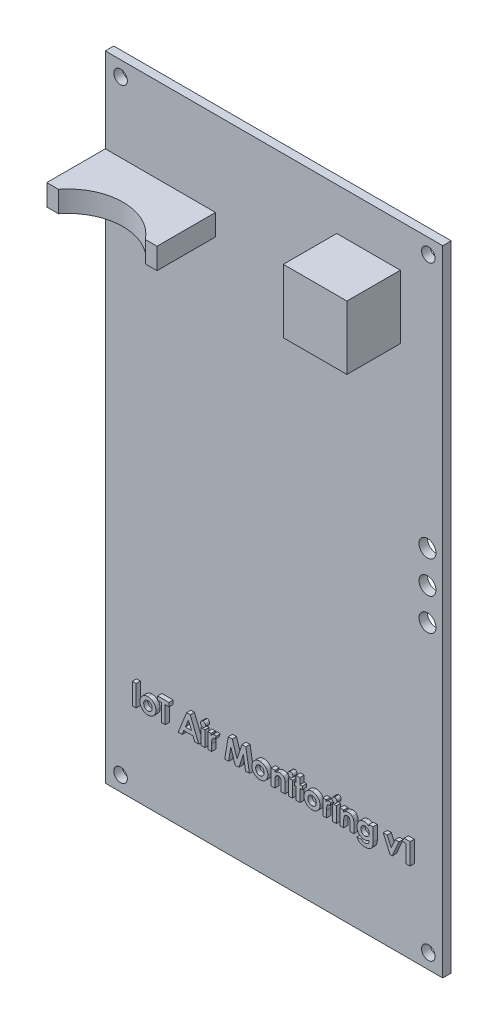
from build123d import *

# Parameters (mm, degrees)
SKICA1_W                 = 79.6
SKICA1_H                 = 149.6
SKICA1_R                 = 1.6
P_IDAT_VYSUNUT_M1_DEPTH  = 2
SKICA2_W                 = 26
SKICA2_H                 = 5
P_IDAT_VYSUNUT_M2_DEPTH  = 8.8
P_IDAT_VYSUNUT_M3_DEPTH  = 5
SKICA4_W                 = 15
SKICA4_H                 = 15
P_IDAT_VYSUNUT_M4_DEPTH  = 12.6
SKICA5_R                 = 2
ODEBRAT_VYSUNUT_M1_DEPTH = 171.01988119
ODEBRAT_VYSUNUT_M2_DEPTH = 0.6
SKICA7_W                 = 0.897435897
SKICA7_H                 = 5
SKICA7_H_2               = 3.653846154
SKICA7_W_2               = 0.897435898
P_IDAT_VYSUNUT_M5_DEPTH  = 1


with BuildPart() as part:
    # Skica1 → Přidat vysunutím1 (new body)
    with BuildSketch(Plane.XY):
        with Locations((39.8, 74.8)):
            Rectangle(SKICA1_W, SKICA1_H)
        with Locations((3.6, 3.5)):
            Circle(SKICA1_R, mode=Mode.SUBTRACT)
        with Locations((76.2, 3.5)):
            Circle(SKICA1_R, mode=Mode.SUBTRACT)
        with Locations((3.6, 146.1)):
            Circle(SKICA1_R, mode=Mode.SUBTRACT)
        with Locations((76.2, 146.1)):
            Circle(SKICA1_R, mode=Mode.SUBTRACT)
    extrude(amount=P_IDAT_VYSUNUT_M1_DEPTH)

    # Skica2 → Přidat vysunutím2 (add)
    with BuildSketch(Plane.XY.offset(2)):
        with Locations((13, 127.1)):
            Rectangle(SKICA2_W, SKICA2_H)
    extrude(amount=P_IDAT_VYSUNUT_M2_DEPTH)

    # Skica3 → Přidat vysunutím3 (add)
    with BuildSketch(Plane.XZ.offset(-124.6)):
        with BuildLine():
            Line((0, 15.8), (0, 10.8))
            Line((0, 10.8), (13, 10.8))
            ThreePointArc((13, 10.8), (7.299122875, 12.116678554), (2.753049234, 15.8))
            Line((2.753049234, 15.8), (0, 15.8))
        make_face()
        with BuildLine():
            ThreePointArc((23.246950766, 15.8), (18.700877125, 12.116678554), (13, 10.8))
            Line((13, 10.8), (26, 10.8))
            Line((26, 10.8), (26, 15.8))
            Line((26, 15.8), (23.246950766, 15.8))
        make_face()
    extrude(amount=-P_IDAT_VYSUNUT_M3_DEPTH)

    # Skica4 → Přidat vysunutím4 (add)
    with BuildSketch(Plane.XY.offset(2)):
        with Locations((62.1, 132.1)):
            Rectangle(SKICA4_W, SKICA4_H)
    extrude(amount=P_IDAT_VYSUNUT_M4_DEPTH)

    # Skica5 → Odebrat vysunutím1 (cut, through all)
    with BuildSketch(Plane.XY.offset(2)):
        with Locations((76, 86)):
            Circle(SKICA5_R)
        with Locations((76, 78.4)):
            Circle(SKICA5_R)
        with Locations((76, 70.8)):
            Circle(SKICA5_R)
    extrude(amount=-ODEBRAT_VYSUNUT_M1_DEPTH, mode=Mode.SUBTRACT)

    # Skica6 → Odebrat vysunutím2 (cut)
    # profile 1 of 8: a face of its own
    with BuildSketch(Plane(origin=(0, 0, 0), x_dir=(-1, 0, 0), z_dir=(0, 0, -1))):
        with BuildLine():
            add(Edge.make_bspline(
                [(-68.652592624, 85.903393002), (-68.627139128, 85.912782083), (-68.576610556, 85.931420656), (-68.504172056, 85.966057147), (-68.434038729, 86.003600843), (-68.367761374, 86.046522688), (-68.305422337, 86.094687755), (-68.246336609, 86.146962606), (-68.190326526, 86.203608682), (-68.138113806, 86.264863735), (-68.090436237, 86.330328852), (-68.048879634, 86.400217873), (-68.012552867, 86.473977215), (-67.984854541, 86.552713825), (-67.960445338, 86.634713992), (-67.944773169, 86.721186882), (-67.932516384, 86.811457528), (-67.930654453, 86.87322378), (-67.929703726, 86.904762441)],
                knots=[0, 0, 0, 0, 0.984448908, 1.954261881, 2.912051287, 3.871106542, 4.816984922, 5.769562366, 6.733317195, 7.706618018, 8.689159246, 9.669611908, 10.655553532, 11.668369991, 12.696152468, 13.758167005, 14.855290571, 16, 16, 16, 16], degree=3))
            add(Edge.make_bspline(
                [(-67.929703726, 86.904762441), (-67.930635591, 86.945137523), (-67.932460283, 87.024196264), (-67.949184376, 87.139195292), (-67.973370928, 87.248108769), (-68.009241271, 87.349929904), (-68.054936536, 87.4451858), (-68.110242746, 87.534243877), (-68.176188411, 87.616341626), (-68.226952483, 87.664932314), (-68.252455108, 87.689343084)],
                knots=[0, 0, 0, 0, 1.106785191, 2.167204112, 3.181420928, 4.162778401, 5.120989717, 6.07402843, 7.032439092, 8, 8, 8, 8], degree=3))
            add(Edge.make_bspline(
                [(-68.252455108, 87.689343084), (-68.284793883, 87.715976971), (-68.350404152, 87.770012925), (-68.463696185, 87.8352041), (-68.588146877, 87.891432958), (-68.725496691, 87.936606292), (-68.8754682, 87.970030473), (-69.037619247, 87.994067703), (-69.212659267, 88.007712841), (-69.333559987, 88.008109892), (-69.39606832, 88.008315177)],
                knots=[0, 0, 0, 0, 0.827221313, 1.678301493, 2.574754406, 3.524835391, 4.531659668, 5.609758117, 6.764192347, 8, 8, 8, 8], degree=3))
            add(Edge.make_bspline(
                [(-69.39606832, 88.008315177), (-69.485785536, 88.006776074), (-69.662612972, 88.003742592), (-69.880911722, 87.989496425), (-70.048187133, 87.971633298), (-70.165742223, 87.958568532), (-70.276098428, 87.94262353), (-70.347214838, 87.930361955), (-70.381707202, 87.924414934)],
                knots=[0, 0, 0, 0, 1.630788357, 3.214189375, 3.973790731, 4.688368382, 5.363841967, 6, 6, 6, 6], degree=3))
            Line((-70.381707202, 87.924414934), (-70.380952082, 84.003382908))
            Line((-70.380952082, 84.003382908), (-69.767194617, 84.003382908))
            Line((-69.767194617, 84.003382908), (-69.767194617, 85.6961447))
            Line((-69.767194617, 85.6961447), (-69.400867724, 85.6961447))
            add(Edge.make_bspline(
                [(-69.400867724, 85.6961447), (-69.375559801, 85.695822503), (-69.326422179, 85.695196929), (-69.254896106, 85.68710562), (-69.187436777, 85.675648172), (-69.124434691, 85.657676785), (-69.066443813, 85.632903869), (-69.012591198, 85.603862137), (-68.963771688, 85.568322217), (-68.91838135, 85.528038283), (-68.87751532, 85.480434128), (-68.839651776, 85.426463363), (-68.804901266, 85.365671052), (-68.773224068, 85.297782025), (-68.743837711, 85.22309626), (-68.717523595, 85.14126285), (-68.694202059, 85.052617116), (-68.681024421, 84.990988347), (-68.674223894, 84.95918385)],
                knots=[0, 0, 0, 0, 1.05460192, 2.04760499, 2.997500883, 3.905099692, 4.771330184, 5.622266628, 6.450198754, 7.283312565, 8.146991563, 9.059198733, 10.028584943, 11.062366604, 12.180106072, 13.372689096, 14.644134814, 16, 16, 16, 16], degree=3))
            add(Edge.make_bspline(
                [(-68.674223894, 84.95918385), (-68.662078666, 84.899931773), (-68.638788002, 84.786305228), (-68.602186785, 84.623910158), (-68.568009455, 84.476545923), (-68.533897561, 84.345660354), (-68.502751647, 84.232400617), (-68.474004029, 84.138075487), (-68.448664143, 84.063278581), (-68.429821419, 84.021066508), (-68.421767309, 84.003023432)],
                knots=[0, 0, 0, 0, 1.465707569, 2.810758609, 4.034056387, 5.131408685, 6.088374617, 6.88023951, 7.521370969, 8, 8, 8, 8], degree=3))
            Line((-68.421767309, 84.003023432), (-67.787885124, 84.003382908))
            add(Edge.make_bspline(
                [(-67.787885124, 84.003382908), (-67.798480059, 84.026296157), (-67.822562203, 84.078377659), (-67.853686443, 84.169741519), (-67.88857368, 84.281283335), (-67.92380761, 84.412969842), (-67.962323129, 84.561570669), (-68.001682542, 84.725644159), (-68.045344029, 84.903011493), (-68.07373154, 85.02616434), (-68.088433914, 85.089947291)],
                knots=[0, 0, 0, 0, 0.536382744, 1.219190635, 2.049369578, 3.02138797, 4.116602825, 5.313141612, 6.608430422, 8, 8, 8, 8], degree=3))
            add(Edge.make_bspline(
                [(-68.088433914, 85.089947291), (-68.10035486, 85.140850106), (-68.123347455, 85.239029217), (-68.171598973, 85.376846545), (-68.226340183, 85.500998408), (-68.289634541, 85.611063615), (-68.363420838, 85.70655897), (-68.448950605, 85.785822612), (-68.545346506, 85.850608224), (-68.616909098, 85.879054421), (-68.653059869, 85.893424386)],
                knots=[0, 0, 0, 0, 1.21940983, 2.351944079, 3.402180539, 4.382494675, 5.308257689, 6.20701365, 7.094249724, 8, 8, 8, 8], degree=3))
            Line((-68.653059869, 85.893424386), (-68.652592624, 85.903393002))
        make_face()
        with BuildLine():
            Line((-69.767194617, 86.125472803), (-69.767194617, 87.501476931))
            add(Edge.make_bspline(
                [(-69.767194617, 87.501476931), (-69.756645476, 87.504279405), (-69.733959932, 87.510306022), (-69.696268676, 87.516841671), (-69.652643661, 87.522739151), (-69.602762101, 87.528176243), (-69.546761061, 87.531601305), (-69.484525682, 87.534629207), (-69.416242623, 87.537061353), (-69.368607809, 87.537294669), (-69.343914116, 87.537415619)],
                knots=[0, 0, 0, 0, 0.614934877, 1.322395026, 2.153817003, 3.09630114, 4.149527974, 5.315346739, 6.6082867, 8, 8, 8, 8], degree=3))
            add(Edge.make_bspline(
                [(-69.343914116, 87.537415619), (-69.316441127, 87.537237755), (-69.262682364, 87.536889713), (-69.183613148, 87.530856155), (-69.108037195, 87.519678504), (-69.035756795, 87.502960937), (-68.966703018, 87.48106223), (-68.901075099, 87.453782463), (-68.838636633, 87.422089675), (-68.780206228, 87.38495294), (-68.725790432, 87.342260697), (-68.679080656, 87.291007497), (-68.638292978, 87.233609344), (-68.604759968, 87.168801439), (-68.579884627, 87.09650703), (-68.55958135, 87.018031633), (-68.548101618, 86.932280214), (-68.545042598, 86.872793264), (-68.543460453, 86.842026224)],
                knots=[0, 0, 0, 0, 1.091256665, 2.135355867, 3.147538717, 4.123639677, 5.079671503, 6.022139661, 6.944350032, 7.857936834, 8.76932751, 9.683078809, 10.602350983, 11.560424328, 12.570427029, 13.633781589, 14.776176296, 16, 16, 16, 16], degree=3))
            add(Edge.make_bspline(
                [(-68.543460453, 86.842026224), (-68.54453542, 86.815539285), (-68.546642466, 86.763622163), (-68.557135748, 86.687873604), (-68.574611515, 86.616205925), (-68.59866045, 86.548668105), (-68.629930443, 86.485712358), (-68.66726214, 86.426792361), (-68.711492062, 86.372141099), (-68.761999175, 86.321529638), (-68.818785181, 86.276150748), (-68.880992725, 86.236814626), (-68.948230357, 86.20350948), (-69.020088768, 86.175120581), (-69.097836245, 86.154454284), (-69.180433425, 86.1387285), (-69.268036359, 86.127606816), (-69.328257689, 86.126194506), (-69.359031276, 86.125472803)],
                knots=[0, 0, 0, 0, 1.040171501, 2.038843028, 2.995952568, 3.931353777, 4.846937716, 5.749610306, 6.664018294, 7.601143361, 8.551071914, 9.51139538, 10.484468404, 11.492790098, 12.538916067, 13.636779592, 14.792375232, 16, 16, 16, 16], degree=3))
            Line((-69.359031276, 86.125472803), (-69.767194617, 86.125472803))
        make_face(mode=Mode.SUBTRACT)
    # profile 2 of 8: a face of its own
    with BuildSketch(Plane(origin=(0, 0, 0), x_dir=(-1, 0, 0), z_dir=(0, 0, -1))):
        with BuildLine():
            add(Edge.make_bspline(
                [(-65.079845071, 87.887777226), (-65.103251934, 87.898499128), (-65.152617456, 87.921111826), (-65.233501283, 87.95124812), (-65.324606268, 87.979635889), (-65.425886609, 88.006118095), (-65.537007193, 88.029079064), (-65.657987632, 88.045189112), (-65.788674671, 88.05596755), (-65.879038177, 88.057936209), (-65.925924067, 88.058957665)],
                knots=[0, 0, 0, 0, 0.710066038, 1.497542928, 2.37906562, 3.341693834, 4.384493934, 5.507055216, 6.706513948, 8, 8, 8, 8], degree=3))
            add(Edge.make_bspline(
                [(-65.925924067, 88.058957665), (-65.975343684, 88.057314524), (-66.071631776, 88.054113063), (-66.211866611, 88.03902754), (-66.344039785, 88.014920552), (-66.468093493, 87.982052591), (-66.583948907, 87.939435119), (-66.691826138, 87.887928326), (-66.791749225, 87.827620448), (-66.882777386, 87.758510244), (-66.964478076, 87.682382025), (-67.035799272, 87.599650371), (-67.096955931, 87.51138474), (-67.147233083, 87.416810084), (-67.18670446, 87.316130871), (-67.214076399, 87.209439852), (-67.233324875, 87.097427788), (-67.235978935, 87.020493147), (-67.237337763, 86.981104103)],
                knots=[0, 0, 0, 0, 1.24605972, 2.427795281, 3.551358678, 4.629716266, 5.658460298, 6.658336329, 7.638577082, 8.5950144, 9.534089131, 10.448178897, 11.343072278, 12.235166994, 13.142080717, 14.061713137, 15.00763471, 16, 16, 16, 16], degree=3))
            add(Edge.make_bspline(
                [(-67.237337763, 86.981104103), (-67.235841629, 86.947809767), (-67.232894309, 86.882221358), (-67.21959447, 86.785876372), (-67.196319049, 86.694010241), (-67.166328559, 86.605364791), (-67.126737283, 86.521070082), (-67.079893889, 86.440277378), (-67.023881212, 86.364246182), (-66.96043735, 86.291903451), (-66.889692704, 86.223243457), (-66.813450612, 86.157303647), (-66.730600166, 86.095338392), (-66.642129069, 86.036560428), (-66.548131233, 85.980381293), (-66.44813561, 85.927621119), (-66.342618485, 85.877530242), (-66.269244862, 85.847951369), (-66.232046572, 85.832955743)],
                knots=[0, 0, 0, 0, 0.982430359, 1.935345551, 2.861473909, 3.773036523, 4.690393026, 5.602681888, 6.522471742, 7.470130913, 8.436760716, 9.427080411, 10.440400235, 11.485043444, 12.557810827, 13.667797358, 14.817641176, 16, 16, 16, 16], degree=3))
            add(Edge.make_bspline(
                [(-66.232046572, 85.832955743), (-66.202962314, 85.820858115), (-66.146609369, 85.797418049), (-66.066149265, 85.759122112), (-65.991482688, 85.721092581), (-65.922841111, 85.681504387), (-65.860313342, 85.640825414), (-65.803455153, 85.59957552), (-65.753080485, 85.556725741), (-65.708168633, 85.513147718), (-65.669365789, 85.467055002), (-65.634850705, 85.41978867), (-65.607138559, 85.369154119), (-65.583077031, 85.317182183), (-65.566080199, 85.261894363), (-65.552865374, 85.204885157), (-65.546292315, 85.145027914), (-65.545418267, 85.104573322), (-65.544971616, 85.083900427)],
                knots=[0, 0, 0, 0, 1.388607844, 2.690532481, 3.927623255, 5.08226696, 6.182233573, 7.215384472, 8.176896206, 9.095953171, 9.970708446, 10.830739382, 11.671250476, 12.511541319, 13.351171065, 14.216280617, 15.088492993, 16, 16, 16, 16], degree=3))
            add(Edge.make_bspline(
                [(-65.544971616, 85.083900427), (-65.545867226, 85.061454484), (-65.547615368, 85.017642216), (-65.556302418, 84.95361875), (-65.572746021, 84.893562507), (-65.59372491, 84.836376962), (-65.621007463, 84.782531701), (-65.654473433, 84.732267694), (-65.694337571, 84.685879698), (-65.739530316, 84.64292375), (-65.790402183, 84.603839379), (-65.847492525, 84.571141745), (-65.909142018, 84.541776077), (-65.976436918, 84.518764415), (-66.048812701, 84.500748785), (-66.126308459, 84.486984771), (-66.20921066, 84.478960258), (-66.266295952, 84.477128769), (-66.295538648, 84.476190564)],
                knots=[0, 0, 0, 0, 0.989950937, 1.932286624, 2.840091741, 3.729158814, 4.613217802, 5.494132279, 6.384308434, 7.30338771, 8.238497294, 9.204167894, 10.197787286, 11.244421132, 12.332593329, 13.482860627, 14.710562059, 16, 16, 16, 16], degree=3))
            add(Edge.make_bspline(
                [(-66.295538648, 84.476190564), (-66.337142946, 84.477413843), (-66.419531947, 84.479836301), (-66.54153465, 84.492897758), (-66.660586136, 84.513806313), (-66.775323045, 84.543838717), (-66.885208181, 84.577655141), (-66.98711676, 84.618168159), (-67.08178673, 84.661454806), (-67.140079102, 84.695424311), (-67.168554682, 84.712018272)],
                knots=[0, 0, 0, 0, 1.091755245, 2.162003133, 3.216267832, 4.260055132, 5.271996961, 6.23076115, 7.135734233, 8, 8, 8, 8], degree=3))
            Line((-67.168554682, 84.712018272), (-67.304502098, 84.201856908))
            add(Edge.make_bspline(
                [(-67.304502098, 84.201856908), (-67.277160364, 84.184845151), (-67.219635792, 84.149053928), (-67.121482319, 84.105441435), (-67.010218365, 84.064527628), (-66.886310022, 84.029248915), (-66.754100453, 83.999407254), (-66.61690836, 83.976351245), (-66.475957986, 83.962693639), (-66.380727477, 83.960362413), (-66.332575691, 83.959183666)],
                knots=[0, 0, 0, 0, 0.761703857, 1.602557085, 2.536844329, 3.567754473, 4.650347393, 5.744907002, 6.85974825, 8, 8, 8, 8], degree=3))
            add(Edge.make_bspline(
                [(-66.332575691, 83.959183666), (-66.277350087, 83.960940603), (-66.169908738, 83.964358722), (-66.013805733, 83.981995328), (-65.867656815, 84.008761278), (-65.731764566, 84.045669121), (-65.605781619, 84.092584704), (-65.490168302, 84.150078211), (-65.384080173, 84.216622853), (-65.289301215, 84.293385541), (-65.205493122, 84.378286823), (-65.131826121, 84.469041383), (-65.069222163, 84.565715869), (-65.018245794, 84.6684149), (-64.97897516, 84.777321049), (-64.950268757, 84.891731587), (-64.932397055, 85.012040164), (-64.930112482, 85.094168097), (-64.928947315, 85.136054631)],
                knots=[0, 0, 0, 0, 1.285635255, 2.501201915, 3.652546696, 4.740889107, 5.774566479, 6.77641306, 7.741186608, 8.683618437, 9.608349835, 10.513231835, 11.399760906, 12.283589774, 13.175918775, 14.08904847, 15.025384736, 16, 16, 16, 16], degree=3))
            add(Edge.make_bspline(
                [(-64.928947315, 85.136054631), (-64.929302351, 85.169602857), (-64.92999861, 85.235393944), (-64.942146805, 85.331878041), (-64.960044801, 85.424705815), (-64.985337133, 85.513711824), (-65.019446982, 85.598306901), (-65.059105642, 85.679804691), (-65.107822956, 85.756633481), (-65.163480085, 85.829960433), (-65.227066906, 85.899590799), (-65.297101634, 85.968016564), (-65.376279709, 86.032709243), (-65.462620799, 86.095476887), (-65.556339013, 86.156071079), (-65.658448326, 86.213291702), (-65.767532989, 86.269552024), (-65.844348167, 86.303260971), (-65.883596017, 86.320484177)],
                knots=[0, 0, 0, 0, 0.989439626, 1.940380097, 2.864963469, 3.778113219, 4.66599554, 5.553908999, 6.449325998, 7.346131361, 8.267509617, 9.229865655, 10.233372073, 11.281958258, 12.379270913, 13.524806285, 14.735327667, 16, 16, 16, 16], degree=3))
            add(Edge.make_bspline(
                [(-65.883596017, 86.320484177), (-65.91444299, 86.333340987), (-65.974531592, 86.358385511), (-66.06027873, 86.398935251), (-66.140760054, 86.437597034), (-66.214000311, 86.477743448), (-66.280869979, 86.518153723), (-66.342005258, 86.557713119), (-66.396624003, 86.597732921), (-66.444919517, 86.638295668), (-66.48804579, 86.67972277), (-66.524191777, 86.724804934), (-66.555766151, 86.771750376), (-66.580869315, 86.822053987), (-66.599586873, 86.875236557), (-66.613242037, 86.930915555), (-66.621925882, 86.989143554), (-66.622522547, 87.028944223), (-66.622825178, 87.049131326)],
                knots=[0, 0, 0, 0, 1.445224602, 2.81523659, 4.101880901, 5.306437408, 6.425914179, 7.480779251, 8.455055295, 9.352231816, 10.20759927, 11.036454723, 11.846470091, 12.650599711, 13.460615078, 14.279959705, 15.12758675, 16, 16, 16, 16], degree=3))
            add(Edge.make_bspline(
                [(-66.622825178, 87.049131326), (-66.621254805, 87.082102008), (-66.618120847, 87.147900883), (-66.587019413, 87.243818154), (-66.534759177, 87.333376445), (-66.476258968, 87.402142861), (-66.418981056, 87.451937648), (-66.368588109, 87.485245027), (-66.312251292, 87.513954701), (-66.250027332, 87.538201675), (-66.181627191, 87.557055461), (-66.106900381, 87.570038081), (-66.026465011, 87.580390004), (-65.970554699, 87.582458845), (-65.941797086, 87.583522959)],
                knots=[0, 0, 0, 0, 1.221869825, 2.438459087, 3.700322146, 5.054532194, 5.771230136, 6.513622565, 7.29218281, 8.116005944, 8.990228273, 9.922773838, 10.931573349, 12, 12, 12, 12], degree=3))
            add(Edge.make_bspline(
                [(-65.941797086, 87.583522959), (-65.901455419, 87.582274896), (-65.823115242, 87.57985126), (-65.710174535, 87.567897284), (-65.605637702, 87.548915343), (-65.510277009, 87.524172568), (-65.424570077, 87.49530242), (-65.34898262, 87.465873246), (-65.28351911, 87.436982685), (-65.244757244, 87.4152388), (-65.226755382, 87.405140462)],
                knots=[0, 0, 0, 0, 1.300339277, 2.525151254, 3.655871472, 4.72127177, 5.696946503, 6.568444816, 7.335154317, 8, 8, 8, 8], degree=3))
            Line((-65.226755382, 87.405140462), (-65.079845071, 87.887777226))
        make_face()
    # profile 3 of 8: a face of its own
    with BuildSketch(Plane(origin=(0, 0, 0), x_dir=(-1, 0, 0), z_dir=(0, 0, -1))):
        Polygon((-61.768095151, 88.007670778), (-64.539601444, 88.007670778), (-64.539601444, 87.490438008), (-63.463339317, 87.490438008), (-63.463339317, 84.010872103), (-62.849581851, 84.010872103), (-62.849581851, 87.490438008), (-61.768095151, 87.490438008), align=None)
    # profile 4 of 8: a face of its own
    with BuildSketch(Plane(origin=(0, 0, 0), x_dir=(-1, 0, 0), z_dir=(0, 0, -1))):
        with BuildLine():
            add(Edge.make_bspline(
                [(-68.859846832, 80.459334856), (-68.924056532, 80.456678004), (-69.049438611, 80.451489978), (-69.232091858, 80.422851217), (-69.404660108, 80.378838875), (-69.566606714, 80.316376121), (-69.718445978, 80.237301553), (-69.859617464, 80.140701125), (-69.990350062, 80.027245461), (-70.109869849, 79.897616206), (-70.216974282, 79.75302336), (-70.311433037, 79.594996459), (-70.390261666, 79.423343034), (-70.456481953, 79.239621516), (-70.507374714, 79.042910235), (-70.545069717, 78.833744892), (-70.568561024, 78.611652009), (-70.57295373, 78.459266357), (-70.57520686, 78.381103918)],
                knots=[0, 0, 0, 0, 1.01693825, 1.985772131, 2.921518734, 3.832117633, 4.727948323, 5.626511184, 6.534414133, 7.463288783, 8.412839634, 9.378967074, 10.373196777, 11.399194858, 12.46754142, 13.586614818, 14.762113956, 16, 16, 16, 16], degree=3))
            add(Edge.make_bspline(
                [(-70.57520686, 78.381103918), (-70.573586328, 78.305951001), (-70.570419264, 78.159076986), (-70.546461045, 77.945114527), (-70.513232425, 77.742586567), (-70.463055098, 77.552585391), (-70.402280276, 77.373566868), (-70.324962275, 77.207668331), (-70.236609276, 77.052541299), (-70.133783973, 76.911040273), (-70.019956272, 76.782416868), (-69.893666243, 76.670711934), (-69.75672286, 76.575490272), (-69.60882456, 76.497001205), (-69.449891949, 76.435730176), (-69.280285179, 76.391372708), (-69.100201057, 76.362823408), (-68.976422578, 76.357915932), (-68.913075034, 76.355404376)],
                knots=[0, 0, 0, 0, 1.222557966, 2.38928844, 3.500048728, 4.559063003, 5.583344684, 6.572073494, 7.532658458, 8.483942143, 9.413076429, 10.322121769, 11.220566177, 12.121066096, 13.040014193, 13.985715855, 14.969126498, 16, 16, 16, 16], degree=3))
            add(Edge.make_bspline(
                [(-68.913075034, 76.355404376), (-68.851767132, 76.356989539), (-68.731432861, 76.360100875), (-68.555484712, 76.384896388), (-68.388125105, 76.424542644), (-68.229821372, 76.481458212), (-68.08079235, 76.555525683), (-67.940210674, 76.644992969), (-67.808681425, 76.751189982), (-67.685767416, 76.872644884), (-67.575348798, 77.011741744), (-67.477564934, 77.166926125), (-67.396534321, 77.340019875), (-67.32852328, 77.528770218), (-67.27497624, 77.734222846), (-67.236433749, 77.955944406), (-67.211101926, 78.19435009), (-67.206471609, 78.358866128), (-67.204080009, 78.443840135)],
                knots=[0, 0, 0, 0, 0.964759122, 1.89361537, 2.791129421, 3.668077106, 4.535429534, 5.405715028, 6.285894481, 7.191747456, 8.120239528, 9.075412678, 10.072429751, 11.12252868, 12.229792465, 13.410030886, 14.662257747, 16, 16, 16, 16], degree=3))
            add(Edge.make_bspline(
                [(-67.204080009, 78.443840135), (-67.205333381, 78.516198474), (-67.207784211, 78.657687297), (-67.228462899, 78.864613788), (-67.262594337, 79.060766818), (-67.308281728, 79.247032324), (-67.367942635, 79.422919868), (-67.441431441, 79.588340691), (-67.528185147, 79.743269617), (-67.626287045, 79.887814347), (-67.738446335, 80.018332564), (-67.862712568, 80.133092852), (-67.999243695, 80.231240851), (-68.148754992, 80.310205536), (-68.30936376, 80.374758418), (-68.482628412, 80.419916531), (-68.667421878, 80.450165468), (-68.794788224, 80.45597543), (-68.859846832, 80.459334856)],
                knots=[0, 0, 0, 0, 1.181997023, 2.311265979, 3.393394717, 4.432710499, 5.441572568, 6.423779709, 7.385757606, 8.339154063, 9.273212536, 10.190881701, 11.096730823, 12.012033381, 12.946898792, 13.918455472, 14.931549697, 16, 16, 16, 16], degree=3))
        make_face()
        with BuildLine():
            add(Edge.make_bspline(
                [(-68.881019714, 79.983898674), (-68.837414838, 79.980170281), (-68.752174935, 79.972881927), (-68.628678139, 79.946415032), (-68.513994024, 79.905638766), (-68.408010958, 79.850614176), (-68.311722783, 79.780925013), (-68.222926498, 79.698752396), (-68.144114977, 79.601766719), (-68.075621207, 79.492029094), (-68.015112991, 79.374041831), (-67.962476311, 79.250568553), (-67.916387026, 79.123421082), (-67.88073909, 78.991262591), (-67.851431758, 78.855389842), (-67.832491496, 78.714855897), (-67.819694564, 78.570307645), (-67.818461715, 78.47233979), (-67.817836737, 78.42267611)],
                knots=[0, 0, 0, 0, 0.999589655, 1.954022852, 2.877517249, 3.773878129, 4.673599429, 5.586311784, 6.531597741, 7.520501744, 8.537853166, 9.559417173, 10.586727125, 11.626167667, 12.685579831, 13.761408337, 14.865171654, 16, 16, 16, 16], degree=3))
            add(Edge.make_bspline(
                [(-67.817836737, 78.42267611), (-67.818815873, 78.368487266), (-67.820735619, 78.262241843), (-67.83262013, 78.105938693), (-67.85389425, 77.95629597), (-67.883001639, 77.812705291), (-67.921953361, 77.676067533), (-67.967505413, 77.54528188), (-68.023360423, 77.421787053), (-68.085756861, 77.305026364), (-68.157273011, 77.198136103), (-68.237295185, 77.103842021), (-68.326189863, 77.023223486), (-68.423159523, 76.956354121), (-68.52881864, 76.903571922), (-68.642591438, 76.865370478), (-68.764266747, 76.838635026), (-68.848684347, 76.833479174), (-68.891911009, 76.830839082)],
                knots=[0, 0, 0, 0, 1.215141369, 2.382468418, 3.512223075, 4.602497428, 5.664896563, 6.695933009, 7.704955915, 8.700973005, 9.661508233, 10.583141316, 11.467103885, 12.344670232, 13.216342825, 14.106081872, 15.030205112, 16, 16, 16, 16], degree=3))
            add(Edge.make_bspline(
                [(-68.891911009, 76.830839082), (-68.934372862, 76.833823886), (-69.017499225, 76.839667152), (-69.137826735, 76.866028997), (-69.250564315, 76.90509597), (-69.354843209, 76.958632719), (-69.451556238, 77.025019056), (-69.539161434, 77.106148144), (-69.62032624, 77.199698431), (-69.69073047, 77.307126573), (-69.753854591, 77.423188402), (-69.808883172, 77.545843458), (-69.856272704, 77.673968536), (-69.893351732, 77.808187235), (-69.92417116, 77.947331059), (-69.944773659, 78.09212863), (-69.958075105, 78.242280818), (-69.959810701, 78.34428954), (-69.960694275, 78.396221079)],
                knots=[0, 0, 0, 0, 0.968573833, 1.896149455, 2.796477749, 3.679461465, 4.558257033, 5.460120664, 6.392036362, 7.372592241, 8.379386201, 9.399199485, 10.432362265, 11.48798156, 12.568687675, 13.676620176, 14.817192429, 16, 16, 16, 16], degree=3))
            add(Edge.make_bspline(
                [(-69.960694275, 78.396221079), (-69.960379061, 78.446892515), (-69.959755514, 78.54712945), (-69.946801607, 78.69494902), (-69.927824674, 78.83872996), (-69.898734478, 78.977442506), (-69.862606826, 79.111863198), (-69.817976494, 79.241822556), (-69.764074379, 79.366816374), (-69.703793527, 79.486912873), (-69.634603112, 79.59789031), (-69.554539833, 79.695910021), (-69.464980091, 79.779485745), (-69.366181546, 79.849410032), (-69.257890561, 79.904733326), (-69.140564887, 79.946440482), (-69.014038132, 79.974170948), (-68.926316056, 79.980352721), (-68.881019714, 79.983898674)],
                knots=[0, 0, 0, 0, 1.136547726, 2.248289582, 3.326834991, 4.389002452, 5.425786828, 6.448433384, 7.469124786, 8.477926495, 9.461316408, 10.397265518, 11.309260955, 12.201738065, 13.104381261, 14.028854752, 14.989125284, 16, 16, 16, 16], degree=3))
        make_face(mode=Mode.SUBTRACT)
    # profile 5 of 8: a face of its own
    with BuildSketch(Plane(origin=(0, 0, 0), x_dir=(-1, 0, 0), z_dir=(0, 0, -1))):
        Polygon((-65.848826547, 76.39019599), (-65.848826547, 78.145652663), (-64.479988308, 78.145652663), (-64.479988308, 78.621088845), (-65.848826547, 78.621088845), (-65.848826547, 79.887148845), (-64.375496839, 79.887148845), (-64.375496839, 80.362585027), (-66.462584012, 80.362585027), (-66.462584012, 76.39019599), align=None)
    # profile 6 of 8: a face of its own
    with BuildSketch(Plane(origin=(0, 0, 0), x_dir=(-1, 0, 0), z_dir=(0, 0, -1))):
        Polygon((-62.94633168, 76.39019599), (-62.94633168, 78.145652663), (-61.577493441, 78.145652663), (-61.577493441, 78.621088845), (-62.94633168, 78.621088845), (-62.94633168, 79.887148845), (-61.473001973, 79.887148845), (-61.473001973, 80.362585027), (-63.560089145, 80.362585027), (-63.560089145, 76.39019599), align=None)
    # profile 7 of 8: a face of its own
    with BuildSketch(Plane(origin=(0, 0, 0), x_dir=(-1, 0, 0), z_dir=(0, 0, -1))):
        with BuildLine():
            add(Edge.make_bspline(
                [(-68.859846832, 72.859334856), (-68.924056532, 72.856678004), (-69.049438611, 72.851489978), (-69.232091858, 72.822851217), (-69.404660108, 72.778838875), (-69.566606714, 72.716376121), (-69.718445978, 72.637301553), (-69.859617464, 72.540701125), (-69.990350062, 72.427245461), (-70.109869849, 72.297616206), (-70.216974282, 72.15302336), (-70.311433037, 71.994996459), (-70.390261666, 71.823343034), (-70.456481953, 71.639621516), (-70.507374714, 71.442910235), (-70.545069717, 71.233744892), (-70.568561024, 71.011652009), (-70.57295373, 70.859266357), (-70.57520686, 70.781103918)],
                knots=[0, 0, 0, 0, 1.01693825, 1.985772131, 2.921518734, 3.832117633, 4.727948323, 5.626511184, 6.534414133, 7.463288783, 8.412839634, 9.378967074, 10.373196777, 11.399194858, 12.46754142, 13.586614818, 14.762113956, 16, 16, 16, 16], degree=3))
            add(Edge.make_bspline(
                [(-70.57520686, 70.781103918), (-70.573586328, 70.705951001), (-70.570419264, 70.559076986), (-70.546461045, 70.345114527), (-70.513232425, 70.142586567), (-70.463055098, 69.952585391), (-70.402280276, 69.773566868), (-70.324962275, 69.607668331), (-70.236609276, 69.452541299), (-70.133783973, 69.311040273), (-70.019956272, 69.182416868), (-69.893666243, 69.070711934), (-69.75672286, 68.975490272), (-69.60882456, 68.897001205), (-69.449891949, 68.835730176), (-69.280285179, 68.791372708), (-69.100201057, 68.762823408), (-68.976422578, 68.757915932), (-68.913075034, 68.755404376)],
                knots=[0, 0, 0, 0, 1.222557966, 2.38928844, 3.500048728, 4.559063003, 5.583344684, 6.572073494, 7.532658458, 8.483942143, 9.413076429, 10.322121769, 11.220566177, 12.121066096, 13.040014193, 13.985715855, 14.969126498, 16, 16, 16, 16], degree=3))
            add(Edge.make_bspline(
                [(-68.913075034, 68.755404376), (-68.851767132, 68.756989539), (-68.731432861, 68.760100875), (-68.555484712, 68.784896388), (-68.388125105, 68.824542644), (-68.229821372, 68.881458212), (-68.08079235, 68.955525683), (-67.940210674, 69.044992969), (-67.808681425, 69.151189982), (-67.685767416, 69.272644884), (-67.575348798, 69.411741744), (-67.477564934, 69.566926125), (-67.396534321, 69.740019875), (-67.32852328, 69.928770218), (-67.27497624, 70.134222846), (-67.236433749, 70.355944406), (-67.211101926, 70.59435009), (-67.206471609, 70.758866128), (-67.204080009, 70.843840135)],
                knots=[0, 0, 0, 0, 0.964759122, 1.89361537, 2.791129421, 3.668077106, 4.535429534, 5.405715028, 6.285894481, 7.191747456, 8.120239528, 9.075412678, 10.072429751, 11.12252868, 12.229792465, 13.410030886, 14.662257747, 16, 16, 16, 16], degree=3))
            add(Edge.make_bspline(
                [(-67.204080009, 70.843840135), (-67.205333381, 70.916198474), (-67.207784211, 71.057687297), (-67.228462899, 71.264613788), (-67.262594337, 71.460766818), (-67.308281728, 71.647032324), (-67.367942635, 71.822919868), (-67.441431441, 71.988340691), (-67.528185147, 72.143269617), (-67.626287045, 72.287814347), (-67.738446335, 72.418332564), (-67.862712568, 72.533092852), (-67.999243695, 72.631240851), (-68.148754992, 72.710205536), (-68.30936376, 72.774758418), (-68.482628412, 72.819916531), (-68.667421878, 72.850165468), (-68.794788224, 72.85597543), (-68.859846832, 72.859334856)],
                knots=[0, 0, 0, 0, 1.181997023, 2.311265979, 3.393394717, 4.432710499, 5.441572568, 6.423779709, 7.385757606, 8.339154063, 9.273212536, 10.190881701, 11.096730823, 12.012033381, 12.946898792, 13.918455472, 14.931549697, 16, 16, 16, 16], degree=3))
        make_face()
        with BuildLine():
            add(Edge.make_bspline(
                [(-68.881019714, 72.383898674), (-68.837414838, 72.380170281), (-68.752174935, 72.372881927), (-68.628678139, 72.346415032), (-68.513994024, 72.305638766), (-68.408010958, 72.250614176), (-68.311722783, 72.180925013), (-68.222926498, 72.098752396), (-68.144114977, 72.001766719), (-68.075621207, 71.892029094), (-68.015112991, 71.774041831), (-67.962476311, 71.650568553), (-67.916387026, 71.523421082), (-67.88073909, 71.391262591), (-67.851431758, 71.255389842), (-67.832491496, 71.114855897), (-67.819694564, 70.970307645), (-67.818461715, 70.87233979), (-67.817836737, 70.82267611)],
                knots=[0, 0, 0, 0, 0.999589655, 1.954022852, 2.877517249, 3.773878129, 4.673599429, 5.586311784, 6.531597741, 7.520501744, 8.537853166, 9.559417173, 10.586727125, 11.626167667, 12.685579831, 13.761408337, 14.865171654, 16, 16, 16, 16], degree=3))
            add(Edge.make_bspline(
                [(-67.817836737, 70.82267611), (-67.818815873, 70.768487266), (-67.820735619, 70.662241843), (-67.83262013, 70.505938693), (-67.85389425, 70.35629597), (-67.883001639, 70.212705291), (-67.921953361, 70.076067533), (-67.967505413, 69.94528188), (-68.023360423, 69.821787053), (-68.085756861, 69.705026364), (-68.157273011, 69.598136103), (-68.237295185, 69.503842021), (-68.326189863, 69.423223486), (-68.423159523, 69.356354121), (-68.52881864, 69.303571922), (-68.642591438, 69.265370478), (-68.764266747, 69.238635026), (-68.848684347, 69.233479174), (-68.891911009, 69.230839082)],
                knots=[0, 0, 0, 0, 1.215141369, 2.382468418, 3.512223075, 4.602497428, 5.664896563, 6.695933009, 7.704955915, 8.700973005, 9.661508233, 10.583141316, 11.467103885, 12.344670232, 13.216342825, 14.106081872, 15.030205112, 16, 16, 16, 16], degree=3))
            add(Edge.make_bspline(
                [(-68.891911009, 69.230839082), (-68.934372862, 69.233823886), (-69.017499225, 69.239667152), (-69.137826735, 69.266028997), (-69.250564315, 69.30509597), (-69.354843209, 69.358632719), (-69.451556238, 69.425019056), (-69.539161434, 69.506148144), (-69.62032624, 69.599698431), (-69.69073047, 69.707126573), (-69.753854591, 69.823188402), (-69.808883172, 69.945843458), (-69.856272704, 70.073968536), (-69.893351732, 70.208187235), (-69.92417116, 70.347331059), (-69.944773659, 70.49212863), (-69.958075105, 70.642280818), (-69.959810701, 70.74428954), (-69.960694275, 70.796221079)],
                knots=[0, 0, 0, 0, 0.968573833, 1.896149455, 2.796477749, 3.679461465, 4.558257033, 5.460120664, 6.392036362, 7.372592241, 8.379386201, 9.399199485, 10.432362265, 11.48798156, 12.568687675, 13.676620176, 14.817192429, 16, 16, 16, 16], degree=3))
            add(Edge.make_bspline(
                [(-69.960694275, 70.796221079), (-69.960379061, 70.846892515), (-69.959755514, 70.94712945), (-69.946801607, 71.09494902), (-69.927824674, 71.23872996), (-69.898734478, 71.377442506), (-69.862606826, 71.511863198), (-69.817976494, 71.641822556), (-69.764074379, 71.766816374), (-69.703793527, 71.886912873), (-69.634603112, 71.99789031), (-69.554539833, 72.095910021), (-69.464980091, 72.179485745), (-69.366181546, 72.249410032), (-69.257890561, 72.304733326), (-69.140564887, 72.346440482), (-69.014038132, 72.374170948), (-68.926316056, 72.380352721), (-68.881019714, 72.383898674)],
                knots=[0, 0, 0, 0, 1.136547726, 2.248289582, 3.326834991, 4.389002452, 5.425786828, 6.448433384, 7.469124786, 8.477926495, 9.461316408, 10.397265518, 11.309260955, 12.201738065, 13.104381261, 14.028854752, 14.989125284, 16, 16, 16, 16], degree=3))
        make_face(mode=Mode.SUBTRACT)
    # profile 8 of 8: a face of its own
    with BuildSketch(Plane(origin=(0, 0, 0), x_dir=(-1, 0, 0), z_dir=(0, 0, -1))):
        with BuildLine():
            Line((-63.575206306, 72.80755858), (-64.140588857, 72.80755858))
            Line((-64.140588857, 72.80755858), (-64.140588857, 71.333166685))
            add(Edge.make_bspline(
                [(-64.140588857, 71.333166685), (-64.140839362, 71.254964512), (-64.141331209, 71.10142042), (-64.137776646, 70.8750685), (-64.133357489, 70.656619254), (-64.125576269, 70.376100918), (-64.109410827, 70.031714639), (-64.088356754, 69.758130894), (-64.077851164, 69.621617688)],
                knots=[0, 0, 0, 0, 0.821614023, 1.613177398, 2.378363483, 3.117216942, 4.56154481, 6, 6, 6, 6], degree=3))
            Line((-64.077851164, 69.621617688), (-64.093001541, 69.616726755))
            add(Edge.make_bspline(
                [(-64.093001541, 69.616726755), (-64.138771664, 69.726308297), (-64.232159613, 69.949895102), (-64.390200742, 70.283476594), (-64.559608466, 70.621659908), (-64.683709804, 70.844036472), (-64.746029669, 70.955707125)],
                knots=[0, 0, 0, 0, 0.955842181, 1.950270942, 2.970689279, 4, 4, 4, 4], degree=3))
            Line((-64.746029669, 70.955707125), (-65.797257689, 72.812093729))
            Line((-65.797257689, 72.812093729), (-66.462584012, 72.812093729))
            Line((-66.462584012, 72.812093729), (-66.462584012, 68.803023432))
            Line((-66.462584012, 68.803023432), (-65.897201461, 68.803023432))
            Line((-65.897201461, 68.803023432), (-65.897201461, 70.294423609))
            add(Edge.make_bspline(
                [(-65.897201461, 70.294423609), (-65.897409678, 70.379804939), (-65.897815745, 70.546316365), (-65.89913857, 70.789677617), (-65.902088638, 71.019971422), (-65.908251624, 71.305958926), (-65.917819174, 71.644978866), (-65.932419629, 71.911387902), (-65.939529512, 72.041119268)],
                knots=[0, 0, 0, 0, 0.879484195, 1.715177864, 2.506803862, 3.251809647, 4.661732754, 6, 6, 6, 6], degree=3))
            Line((-65.939529512, 72.041119268), (-65.918335961, 72.046726937))
            add(Edge.make_bspline(
                [(-65.918335961, 72.046726937), (-65.869857711, 71.931334228), (-65.771827384, 71.697992779), (-65.607394689, 71.353341797), (-65.433014315, 71.011720427), (-65.311354796, 70.786914654), (-65.250942839, 70.675283793)],
                knots=[0, 0, 0, 0, 0.984107413, 1.990013513, 3.00190943, 4, 4, 4, 4], degree=3))
            Line((-65.250942839, 70.675283793), (-64.193181518, 68.803023432))
            Line((-64.193181518, 68.803023432), (-63.575206306, 68.803023432))
            Line((-63.575206306, 68.803023432), (-63.575206306, 72.80755858))
        make_face()
    extrude(amount=-ODEBRAT_VYSUNUT_M2_DEPTH, mode=Mode.SUBTRACT)

    # Skica7 → Přidat vysunutím5 (add)
    # profile 1 of 21: a face of its own
    with BuildSketch(Plane.XY.offset(2)):
        with Locations((7.820512821, 22.5)):
            Rectangle(SKICA7_W, SKICA7_H)
    # profile 2 of 21: a face of its own
    with BuildSketch(Plane.XY.offset(2)):
        with BuildLine():
            add(Edge.make_bspline(
                [(11.035657051, 23.717948718), (11.078086088, 23.717193664), (11.162114806, 23.715698316), (11.287265085, 23.703250905), (11.410227448, 23.68294244), (11.531708667, 23.656646524), (11.650580675, 23.619802012), (11.767466942, 23.575612717), (11.883412578, 23.524878239), (11.995539838, 23.464486464), (12.104658756, 23.398986076), (12.208109984, 23.326733774), (12.305034431, 23.248297076), (12.397231346, 23.165494596), (12.480404202, 23.074721387), (12.559868192, 22.980351281), (12.631330069, 22.879003328), (12.697493474, 22.773147142), (12.756398277, 22.663394869), (12.807546266, 22.550509985), (12.851937911, 22.436053203), (12.886695679, 22.318630361), (12.915471908, 22.199789837), (12.933631753, 22.078075326), (12.946542144, 21.954737145), (12.947989808, 21.871695731), (12.948717949, 21.829927885)],
                knots=[0, 0, 0, 0, 1.022364134, 2.024744242, 3.027414945, 4.024939316, 5.017584196, 6.023349371, 7.035562955, 8.064994934, 9.090267829, 10.101425541, 11.102933353, 12.093946398, 13.084502048, 14.067315274, 15.065326281, 16.070028806, 17.074376865, 18.064572984, 19.055292013, 20.030201733, 21.013838017, 21.999348303, 22.993720005, 24, 24, 24, 24], degree=3))
            add(Edge.make_bspline(
                [(12.948717949, 21.829927885), (12.947949517, 21.787833727), (12.946421701, 21.704140998), (12.934098835, 21.579642669), (12.913712637, 21.457355792), (12.887315795, 21.336559955), (12.850609166, 21.218800856), (12.807721388, 21.102342681), (12.755074953, 20.988772796), (12.696870439, 20.876852262), (12.630281632, 20.769874558), (12.558881613, 20.667511343), (12.479750457, 20.572448084), (12.397243423, 20.481736605), (12.307447014, 20.398444362), (12.21179455, 20.321218911), (12.111114114, 20.249116138), (12.004681709, 20.183827708), (11.893860556, 20.126461092), (11.780519632, 20.074740407), (11.663996183, 20.031679244), (11.544531361, 19.996564051), (11.422052714, 19.969375236), (11.296830643, 19.950905551), (11.169134831, 19.938060097), (11.083098421, 19.936622964), (11.039663462, 19.935897436)],
                knots=[0, 0, 0, 0, 1.012026251, 2.012137606, 3.004615893, 3.992048833, 4.982446996, 5.968083444, 6.973977695, 7.990229942, 8.999482246, 10.001782172, 10.988562221, 11.971415814, 12.948383116, 13.930088534, 14.925840678, 15.924049238, 16.929462851, 17.924729459, 18.917889337, 19.913673841, 20.916777188, 21.931792057, 22.95587778, 24, 24, 24, 24], degree=3))
            add(Edge.make_bspline(
                [(11.039663462, 19.935897436), (10.976152694, 19.937761602), (10.850972005, 19.941435902), (10.666610446, 19.966603896), (10.489499846, 20.009924613), (10.319351606, 20.070312737), (10.155944699, 20.147697867), (10.000705211, 20.243473717), (9.852088931, 20.355754736), (9.712670005, 20.483591913), (9.584943382, 20.623840872), (9.473358809, 20.773555781), (9.378614477, 20.930492666), (9.300795627, 21.094830487), (9.240735343, 21.266794596), (9.197361571, 21.44587088), (9.172162806, 21.632562697), (9.168519582, 21.759406502), (9.166666667, 21.823918269)],
                knots=[0, 0, 0, 0, 1.029999031, 2.030143771, 3.011211297, 3.982305373, 4.953580601, 5.938004764, 6.935448627, 7.970290061, 9.001484052, 10.007591832, 10.993831261, 11.969999897, 12.951306496, 13.942897864, 14.953773953, 16, 16, 16, 16], degree=3))
            add(Edge.make_bspline(
                [(9.166666667, 21.823918269), (9.168584199, 21.892802694), (9.172353069, 22.028193653), (9.202279562, 22.226544493), (9.250068943, 22.416456022), (9.318667588, 22.597396997), (9.406296324, 22.76970114), (9.513271151, 22.933005041), (9.640120746, 23.087345692), (9.737262135, 23.180696209), (9.786658654, 23.228165064)],
                knots=[0, 0, 0, 0, 1.043912699, 2.05178951, 3.033892, 4.007821512, 4.978932272, 5.95884105, 6.962068106, 8, 8, 8, 8], degree=3))
            add(Edge.make_bspline(
                [(9.786658654, 23.228165064), (9.831984897, 23.267511406), (9.921404192, 23.345133593), (10.066681116, 23.443584611), (10.215428294, 23.528616255), (10.369428523, 23.598528082), (10.529111117, 23.651240471), (10.693657793, 23.689610374), (10.863034336, 23.713178293), (10.97782373, 23.716350495), (11.035657051, 23.717948718)],
                knots=[0, 0, 0, 0, 1.048115528, 2.067714963, 3.060638214, 4.039924844, 5.017819947, 5.994373833, 6.98952318, 8, 8, 8, 8], degree=3))
        make_face()
        with BuildLine():
            add(Edge.make_bspline(
                [(11.055689103, 22.884615385), (11.020942847, 22.883460534), (10.95254447, 22.881187199), (10.851860261, 22.868986814), (10.756632077, 22.843981078), (10.664968507, 22.812180626), (10.578491089, 22.769652001), (10.494831514, 22.71988371), (10.418339897, 22.657604818), (10.345314564, 22.589289429), (10.279023839, 22.513427023), (10.222537846, 22.430774988), (10.17206636, 22.344495419), (10.133796392, 22.251429512), (10.102124334, 22.154121029), (10.080689066, 22.050997761), (10.065771616, 21.94321165), (10.064664206, 21.869377426), (10.064102564, 21.83193109)],
                knots=[0, 0, 0, 0, 1.030650113, 2.02884584, 2.99876339, 3.944280128, 4.900564847, 5.851248946, 6.823638398, 7.81794922, 8.81432732, 9.802856497, 10.78262424, 11.771747962, 12.779760563, 13.812642396, 14.89064281, 16, 16, 16, 16], degree=3))
            add(Edge.make_bspline(
                [(10.064102564, 21.83193109), (10.064759762, 21.793164207), (10.066044129, 21.717401781), (10.079344017, 21.60677845), (10.101275972, 21.501797642), (10.132434406, 21.402621529), (10.171621398, 21.308538239), (10.219699293, 21.220075642), (10.2771755, 21.137765628), (10.342339567, 21.061709558), (10.413691438, 20.992672621), (10.49187324, 20.933427705), (10.573611014, 20.881951736), (10.660788441, 20.840608588), (10.752167353, 20.808688323), (10.848019014, 20.785186506), (10.948847127, 20.772524866), (11.017595965, 20.7703439), (11.052684295, 20.769230769)],
                knots=[0, 0, 0, 0, 1.141730614, 2.231293227, 3.276944405, 4.297399982, 5.28939179, 6.275415646, 7.257752684, 8.24146775, 9.222424823, 10.176631434, 11.126518621, 12.063689483, 13.012557477, 13.974037417, 14.965980454, 16, 16, 16, 16], degree=3))
            add(Edge.make_bspline(
                [(11.052684295, 20.769230769), (11.087790174, 20.770218066), (11.156618076, 20.772153741), (11.257564592, 20.786648888), (11.353905743, 20.809461392), (11.446065102, 20.841656383), (11.533297552, 20.883884459), (11.615937026, 20.935606696), (11.694710514, 20.995675655), (11.767019934, 21.066015188), (11.833955381, 21.14230845), (11.892653765, 21.225052973), (11.941704348, 21.313515593), (11.981934609, 21.407139703), (12.013154125, 21.505796619), (12.034722992, 21.609853034), (12.049648417, 21.718986471), (12.050730782, 21.793817927), (12.051282051, 21.83193109)],
                knots=[0, 0, 0, 0, 1.031504075, 2.022346795, 2.991027682, 3.937587355, 4.885570121, 5.833146507, 6.798790848, 7.791235734, 8.792807298, 9.778388351, 10.766749885, 11.760164525, 12.768777521, 13.802286646, 14.880660483, 16, 16, 16, 16], degree=3))
            add(Edge.make_bspline(
                [(12.051282051, 21.83193109), (12.050616493, 21.870030932), (12.049310452, 21.944795181), (12.036009616, 22.054076219), (12.014292895, 22.157796295), (11.982732586, 22.255512532), (11.943778516, 22.348339719), (11.895667389, 22.435802706), (11.837907729, 22.517470718), (11.77242688, 22.592938798), (11.7000054, 22.661006989), (11.623181023, 22.721707292), (11.540197011, 22.771911106), (11.452610194, 22.813296971), (11.360187545, 22.845137485), (11.263032825, 22.868772494), (11.160848285, 22.881253964), (11.09110851, 22.883483201), (11.055689103, 22.884615385)],
                knots=[0, 0, 0, 0, 1.123894411, 2.205445421, 3.243160173, 4.246488011, 5.231014757, 6.210004299, 7.185865357, 8.177612767, 9.153374344, 10.115157457, 11.061423229, 12.009021698, 12.96873347, 13.94135618, 14.954456845, 16, 16, 16, 16], degree=3))
        make_face(mode=Mode.SUBTRACT)
    # profile 3 of 21: a face of its own
    with BuildSketch(Plane.XY.offset(2)):
        Polygon((13.333333333, 25), (16.025641026, 25), (16.025641026, 24.102564103), (15.128205128, 24.102564103), (15.128205128, 20), (14.230769231, 20), (14.230769231, 24.102564103), (13.333333333, 24.102564103), align=None)
    # profile 4 of 21: a face of its own
    with BuildSketch(Plane.XY.offset(2)):
        Polygon((20.193309295, 25), (21.025641026, 25), (23.044871795, 20), (22.086338141, 20), (21.697716346, 21.025641026), (19.519230769, 21.025641026), (19.130608974, 20), (18.173076923, 20), align=None)
        Polygon((20.608974359, 23.658854167), (19.859775641, 21.923076923), (21.358173077, 21.923076923), align=None, mode=Mode.SUBTRACT)
    # profile 5 of 21: a face of its own
    with BuildSketch(Plane.XY.offset(2)):
        with BuildLine():
            add(Edge.make_bspline(
                [(24.036458333, 25.192307692), (24.075137814, 25.190409931), (24.151088701, 25.186683493), (24.259898683, 25.150359012), (24.359764194, 25.093348824), (24.448048075, 25.015129488), (24.521474352, 24.921721294), (24.577574755, 24.817144611), (24.608825952, 24.701277014), (24.613166281, 24.62123689), (24.615384615, 24.580328526)],
                knots=[0, 0, 0, 0, 0.989868614, 1.943702388, 2.910836514, 3.924849579, 4.949916355, 5.946401046, 6.950409252, 8, 8, 8, 8], degree=3))
            add(Edge.make_bspline(
                [(24.615384615, 24.580328526), (24.613245649, 24.539721634), (24.609077772, 24.460597171), (24.576855489, 24.34630253), (24.523006762, 24.24177664), (24.448985778, 24.149755731), (24.361659009, 24.072796164), (24.263975636, 24.014750991), (24.15620837, 23.980447233), (24.081436011, 23.976409285), (24.043469551, 23.974358974)],
                knots=[0, 0, 0, 0, 1.05296456, 2.051751585, 3.055639087, 4.085634717, 5.099016424, 6.062201612, 7.016062274, 8, 8, 8, 8], degree=3))
            add(Edge.make_bspline(
                [(24.043469551, 23.974358974), (24.004452431, 23.976249952), (23.927840774, 23.979962961), (23.818138326, 24.016372433), (23.716940865, 24.072933628), (23.629039958, 24.152751107), (23.554772787, 24.246823036), (23.501122872, 24.353834355), (23.467563523, 24.470494252), (23.463580057, 24.551719825), (23.461538462, 24.593349359)],
                knots=[0, 0, 0, 0, 0.989065327, 1.942068821, 2.907541208, 3.917690034, 4.939857478, 5.938239964, 6.943311734, 8, 8, 8, 8], degree=3))
            add(Edge.make_bspline(
                [(23.461538462, 24.593349359), (23.463760276, 24.633266722), (23.46812471, 24.711678618), (23.499563106, 24.824970139), (23.554377128, 24.927788725), (23.627274508, 25.019486994), (23.71478296, 25.096247245), (23.81458852, 25.151525996), (23.922666206, 25.186350173), (23.998135972, 25.190301348), (24.036458333, 25.192307692)],
                knots=[0, 0, 0, 0, 1.038616768, 2.040212704, 3.031499824, 4.052181184, 5.074969369, 6.039807101, 7.004644834, 8, 8, 8, 8], degree=3))
        make_face()
    # profile 6 of 21: a face of its own
    with BuildSketch(Plane.XY.offset(2)):
        with Locations((24.038461539, 21.826923077)):
            Rectangle(SKICA7_W, SKICA7_H_2)
    # profile 7 of 21: a face of its own
    with BuildSketch(Plane.XY.offset(2)):
        with BuildLine():
            Line((25.192307692, 23.653846154), (25.961538462, 23.653846154))
            Line((25.961538462, 23.653846154), (25.961538462, 23.204126603))
            add(Edge.make_bspline(
                [(25.961538462, 23.204126603), (25.983298523, 23.244093303), (26.025829467, 23.322209877), (26.103962377, 23.427065907), (26.193724628, 23.515372731), (26.291890786, 23.588977364), (26.398758373, 23.646344949), (26.511465665, 23.687226586), (26.629048453, 23.713793984), (26.709259445, 23.716553835), (26.749799679, 23.717948718)],
                knots=[0, 0, 0, 0, 1.09866127, 2.147379032, 3.14564304, 4.131443017, 5.102343063, 6.064490016, 7.021754664, 8, 8, 8, 8], degree=3))
            add(Edge.make_bspline(
                [(26.749799679, 23.717948718), (26.779236948, 23.716570282), (26.839181739, 23.713763293), (26.930546036, 23.697446228), (27.023228559, 23.66794187), (27.084221646, 23.641377117), (27.115384615, 23.627804487)],
                knots=[0, 0, 0, 0, 0.931404136, 1.896671404, 2.925354185, 4, 4, 4, 4], degree=3))
            Line((27.115384615, 23.627804487), (26.836939103, 22.867588141))
            add(Edge.make_bspline(
                [(26.836939103, 22.867588141), (26.81205005, 22.879613328), (26.765268212, 22.90221605), (26.697349106, 22.928889591), (26.635709702, 22.945164482), (26.596631451, 22.947592838), (26.578525641, 22.948717949)],
                knots=[0, 0, 0, 0, 1.214386998, 2.282580073, 3.20428172, 4, 4, 4, 4], degree=3))
            add(Edge.make_bspline(
                [(26.578525641, 22.948717949), (26.561430235, 22.947972391), (26.527800627, 22.94650575), (26.478164266, 22.933937138), (26.431417151, 22.912262956), (26.385306539, 22.884496178), (26.343470048, 22.845898279), (26.301659398, 22.801214359), (26.264813615, 22.746046115), (26.225930628, 22.684641058), (26.192823154, 22.609481324), (26.164434515, 22.51975609), (26.13914001, 22.414427173), (26.121733937, 22.292935329), (26.104910269, 22.156456201), (26.094896408, 22.003988048), (26.087432952, 21.836012991), (26.086976611, 21.718760338), (26.086738782, 21.657652244)],
                knots=[0, 0, 0, 0, 0.544232178, 1.070598461, 1.618251235, 2.182094276, 2.777567932, 3.425210017, 4.127676488, 4.886675562, 5.738955394, 6.734782583, 7.883056018, 9.186093582, 10.642914445, 12.264202625, 14.053029461, 16, 16, 16, 16], degree=3))
            Line((26.086738782, 21.657652244), (26.08974359, 21.479366987))
            Line((26.08974359, 21.479366987), (26.08974359, 20))
            Line((26.08974359, 20), (25.192307692, 20))
            Line((25.192307692, 20), (25.192307692, 23.653846154))
        make_face()
    # profile 8 of 21: a face of its own
    with BuildSketch(Plane.XY.offset(2)):
        Polygon((30.011017628, 25), (30.942508013, 25), (32.083333333, 21.512419872), (33.232171474, 25), (34.154647436, 25), (35, 20), (34.091546474, 20), (33.557692308, 23.158052885), (32.518028846, 20), (31.642628205, 20), (30.608974359, 23.158052885), (30.076121795, 20), (29.166666667, 20), align=None)
    # profile 9 of 21: a face of its own
    with BuildSketch(Plane.XY.offset(2)):
        with BuildLine():
            add(Edge.make_bspline(
                [(37.445913462, 23.717948718), (37.488342498, 23.717193664), (37.572371216, 23.715698316), (37.697521495, 23.703250905), (37.820483858, 23.68294244), (37.941965077, 23.656646524), (38.060837085, 23.619802012), (38.177723352, 23.575612717), (38.293668989, 23.524878239), (38.405796248, 23.464486464), (38.514915166, 23.398986076), (38.618366394, 23.326733774), (38.715290842, 23.248297076), (38.807487756, 23.165494596), (38.890660612, 23.074721387), (38.970124602, 22.980351281), (39.041586479, 22.879003328), (39.107749884, 22.773147142), (39.166654687, 22.663394869), (39.217802676, 22.550509985), (39.262194321, 22.436053203), (39.296952089, 22.318630361), (39.325728318, 22.199789837), (39.343888164, 22.078075326), (39.356798555, 21.954737145), (39.358246219, 21.871695731), (39.358974359, 21.829927885)],
                knots=[0, 0, 0, 0, 1.022364134, 2.024744242, 3.027414945, 4.024939316, 5.017584196, 6.023349371, 7.035562955, 8.064994934, 9.090267829, 10.101425541, 11.102933353, 12.093946398, 13.084502048, 14.067315274, 15.065326281, 16.070028806, 17.074376865, 18.064572984, 19.055292013, 20.030201733, 21.013838017, 21.999348303, 22.993720005, 24, 24, 24, 24], degree=3))
            add(Edge.make_bspline(
                [(39.358974359, 21.829927885), (39.358205927, 21.787833727), (39.356678111, 21.704140998), (39.344355246, 21.579642669), (39.323969047, 21.457355792), (39.297572206, 21.336559955), (39.260865576, 21.218800856), (39.217977798, 21.102342681), (39.165331363, 20.988772796), (39.10712685, 20.876852262), (39.040538042, 20.769874558), (38.969138023, 20.667511343), (38.890006867, 20.572448084), (38.807499833, 20.481736605), (38.717703424, 20.398444362), (38.62205096, 20.321218911), (38.521370525, 20.249116138), (38.414938119, 20.183827708), (38.304116966, 20.126461092), (38.190776042, 20.074740407), (38.074252593, 20.031679244), (37.954787771, 19.996564051), (37.832309124, 19.969375236), (37.707087053, 19.950905551), (37.579391241, 19.938060097), (37.493354831, 19.936622964), (37.449919872, 19.935897436)],
                knots=[0, 0, 0, 0, 1.012026251, 2.012137606, 3.004615893, 3.992048833, 4.982446996, 5.968083444, 6.973977695, 7.990229942, 8.999482246, 10.001782172, 10.988562221, 11.971415814, 12.948383116, 13.930088534, 14.925840678, 15.924049238, 16.929462851, 17.924729459, 18.917889337, 19.913673841, 20.916777188, 21.931792057, 22.95587778, 24, 24, 24, 24], degree=3))
            add(Edge.make_bspline(
                [(37.449919872, 19.935897436), (37.386409105, 19.937761602), (37.261228415, 19.941435902), (37.076866856, 19.966603896), (36.899756256, 20.009924613), (36.729608016, 20.070312737), (36.56620111, 20.147697867), (36.410961621, 20.243473717), (36.262345341, 20.355754736), (36.122926415, 20.483591913), (35.995199792, 20.623840872), (35.88361522, 20.773555781), (35.788870888, 20.930492666), (35.711052037, 21.094830487), (35.650991754, 21.266794596), (35.607617981, 21.44587088), (35.582419216, 21.632562697), (35.578775992, 21.759406502), (35.576923077, 21.823918269)],
                knots=[0, 0, 0, 0, 1.029999031, 2.030143771, 3.011211297, 3.982305373, 4.953580601, 5.938004764, 6.935448627, 7.970290061, 9.001484052, 10.007591832, 10.993831261, 11.969999897, 12.951306496, 13.942897864, 14.953773953, 16, 16, 16, 16], degree=3))
            add(Edge.make_bspline(
                [(35.576923077, 21.823918269), (35.578840609, 21.892802694), (35.58260948, 22.028193653), (35.612535972, 22.226544493), (35.660325353, 22.416456022), (35.728923998, 22.597396997), (35.816552734, 22.76970114), (35.923527562, 22.933005041), (36.050377157, 23.087345692), (36.147518546, 23.180696209), (36.196915064, 23.228165064)],
                knots=[0, 0, 0, 0, 1.043912699, 2.05178951, 3.033892, 4.007821512, 4.978932272, 5.95884105, 6.962068106, 8, 8, 8, 8], degree=3))
            add(Edge.make_bspline(
                [(36.196915064, 23.228165064), (36.242241307, 23.267511406), (36.331660602, 23.345133593), (36.476937527, 23.443584611), (36.625684704, 23.528616255), (36.779684933, 23.598528082), (36.939367527, 23.651240471), (37.103914203, 23.689610374), (37.273290746, 23.713178293), (37.38808014, 23.716350495), (37.445913462, 23.717948718)],
                knots=[0, 0, 0, 0, 1.048115528, 2.067714963, 3.060638214, 4.039924844, 5.017819947, 5.994373833, 6.98952318, 8, 8, 8, 8], degree=3))
        make_face()
        with BuildLine():
            add(Edge.make_bspline(
                [(37.465945513, 22.884615385), (37.431199258, 22.883460534), (37.36280088, 22.881187199), (37.262116672, 22.868986814), (37.166888487, 22.843981078), (37.075224917, 22.812180626), (36.988747499, 22.769652001), (36.905087924, 22.71988371), (36.828596308, 22.657604818), (36.755570974, 22.589289429), (36.689280249, 22.513427023), (36.632794256, 22.430774988), (36.58232277, 22.344495419), (36.544052802, 22.251429512), (36.512380745, 22.154121029), (36.490945476, 22.050997761), (36.476028026, 21.94321165), (36.474920617, 21.869377426), (36.474358974, 21.83193109)],
                knots=[0, 0, 0, 0, 1.030650113, 2.02884584, 2.99876339, 3.944280128, 4.900564847, 5.851248946, 6.823638398, 7.81794922, 8.81432732, 9.802856497, 10.78262424, 11.771747962, 12.779760563, 13.812642396, 14.89064281, 16, 16, 16, 16], degree=3))
            add(Edge.make_bspline(
                [(36.474358974, 21.83193109), (36.475016172, 21.793164207), (36.476300539, 21.717401781), (36.489600428, 21.60677845), (36.511532382, 21.501797642), (36.542690817, 21.402621529), (36.581877809, 21.308538239), (36.629955704, 21.220075642), (36.68743191, 21.137765628), (36.752595978, 21.061709558), (36.823947849, 20.992672621), (36.902129651, 20.933427705), (36.983867424, 20.881951736), (37.071044851, 20.840608588), (37.162423763, 20.808688323), (37.258275425, 20.785186506), (37.359103537, 20.772524866), (37.427852376, 20.7703439), (37.462940705, 20.769230769)],
                knots=[0, 0, 0, 0, 1.141730614, 2.231293227, 3.276944405, 4.297399982, 5.28939179, 6.275415646, 7.257752684, 8.24146775, 9.222424823, 10.176631434, 11.126518621, 12.063689483, 13.012557477, 13.974037417, 14.965980454, 16, 16, 16, 16], degree=3))
            add(Edge.make_bspline(
                [(37.462940705, 20.769230769), (37.498046584, 20.770218066), (37.566874486, 20.772153741), (37.667821003, 20.786648888), (37.764162153, 20.809461392), (37.856321512, 20.841656383), (37.943553962, 20.883884459), (38.026193436, 20.935606696), (38.104966924, 20.995675655), (38.177276344, 21.066015188), (38.244211792, 21.14230845), (38.302910175, 21.225052973), (38.351960758, 21.313515593), (38.39219102, 21.407139703), (38.423410535, 21.505796619), (38.444979402, 21.609853034), (38.459904828, 21.718986471), (38.460987192, 21.793817927), (38.461538462, 21.83193109)],
                knots=[0, 0, 0, 0, 1.031504075, 2.022346795, 2.991027682, 3.937587355, 4.885570121, 5.833146507, 6.798790848, 7.791235734, 8.792807298, 9.778388351, 10.766749885, 11.760164525, 12.768777521, 13.802286646, 14.880660483, 16, 16, 16, 16], degree=3))
            add(Edge.make_bspline(
                [(38.461538462, 21.83193109), (38.460872903, 21.870030932), (38.459566862, 21.944795181), (38.446266026, 22.054076219), (38.424549305, 22.157796295), (38.392988996, 22.255512532), (38.354034926, 22.348339719), (38.3059238, 22.435802706), (38.248164139, 22.517470718), (38.18268329, 22.592938798), (38.11026181, 22.661006989), (38.033437433, 22.721707292), (37.950453421, 22.771911106), (37.862866604, 22.813296971), (37.770443956, 22.845137485), (37.673289236, 22.868772494), (37.571104695, 22.881253964), (37.50136492, 22.883483201), (37.465945513, 22.884615385)],
                knots=[0, 0, 0, 0, 1.123894411, 2.205445421, 3.243160173, 4.246488011, 5.231014757, 6.210004299, 7.185865357, 8.177612767, 9.153374344, 10.115157457, 11.061423229, 12.009021698, 12.96873347, 13.94135618, 14.954456845, 16, 16, 16, 16], degree=3))
        make_face(mode=Mode.SUBTRACT)
    # profile 10 of 21: a face of its own
    with BuildSketch(Plane.XY.offset(2)):
        with BuildLine():
            Line((40.128205128, 23.653846154), (41.025641026, 23.653846154))
            Line((41.025641026, 23.653846154), (41.025641026, 23.267227564))
            add(Edge.make_bspline(
                [(41.025641026, 23.267227564), (41.076839299, 23.307050635), (41.174689151, 23.383160266), (41.323437822, 23.480200433), (41.46383815, 23.559623913), (41.59901981, 23.620037476), (41.731526248, 23.663502437), (41.863503501, 23.694729418), (41.996916977, 23.714724913), (42.086603218, 23.716874693), (42.131410256, 23.717948718)],
                knots=[0, 0, 0, 0, 1.276643801, 2.439914479, 3.493451431, 4.44993799, 5.350072675, 6.235028322, 7.118224225, 8, 8, 8, 8], degree=3))
            add(Edge.make_bspline(
                [(42.131410256, 23.717948718), (42.176860967, 23.71672133), (42.26608453, 23.714311863), (42.39746131, 23.697459598), (42.522979065, 23.666766285), (42.644049138, 23.626013867), (42.759439243, 23.572223013), (42.870562979, 23.5083551), (42.975033448, 23.430559662), (43.039370988, 23.371314391), (43.071915064, 23.341346154)],
                knots=[0, 0, 0, 0, 1.048836932, 2.058954983, 3.049370783, 4.026390553, 5.001981509, 5.982488534, 6.97947532, 8, 8, 8, 8], degree=3))
            add(Edge.make_bspline(
                [(43.071915064, 23.341346154), (43.098016611, 23.313574362), (43.150410738, 23.257827521), (43.216342164, 23.162430399), (43.272918743, 23.058430074), (43.319275388, 22.944626869), (43.353531081, 22.820395511), (43.379884454, 22.687236534), (43.394671791, 22.544404349), (43.396497357, 22.446279985), (43.397435897, 22.395833333)],
                knots=[0, 0, 0, 0, 0.889584746, 1.785680191, 2.700364693, 3.65222533, 4.649950538, 5.707241244, 6.821271309, 8, 8, 8, 8], degree=3))
            Line((43.397435897, 22.395833333), (43.397435897, 20))
            Line((43.397435897, 20), (42.5, 20))
            Line((42.5, 20), (42.5, 21.586538462))
            add(Edge.make_bspline(
                [(42.5, 21.586538462), (42.499810212, 21.638288582), (42.499446519, 21.737458084), (42.496654159, 21.879384543), (42.491201847, 22.007562568), (42.486232207, 22.122225532), (42.476474827, 22.222966304), (42.467675464, 22.310422652), (42.454173695, 22.383801165), (42.436605703, 22.462730764), (42.405927663, 22.547239335), (42.3583015, 22.636283075), (42.297881034, 22.711927718), (42.227134078, 22.774703569), (42.146138765, 22.824365025), (42.055873808, 22.859304953), (41.956823133, 22.881080374), (41.887805786, 22.883407068), (41.851963141, 22.884615385)],
                knots=[0, 0, 0, 0, 1.49886392, 2.872294502, 4.110984203, 5.214877267, 6.195405875, 7.042225351, 7.75923308, 8.355011229, 9.382752534, 10.352059385, 11.267231453, 12.171456522, 13.078624015, 14.003401117, 14.963110155, 16, 16, 16, 16], degree=3))
            add(Edge.make_bspline(
                [(41.851963141, 22.884615385), (41.805348273, 22.882251532), (41.71416053, 22.877627377), (41.582275701, 22.842757031), (41.461141683, 22.783452836), (41.351748241, 22.701387755), (41.255137255, 22.600068244), (41.175565884, 22.479233104), (41.110301013, 22.341798684), (41.082236149, 22.241449235), (41.067708333, 22.189503205)],
                knots=[0, 0, 0, 0, 0.984188326, 1.925263693, 2.85911992, 3.81709677, 4.80007086, 5.801799564, 6.862098548, 8, 8, 8, 8], degree=3))
            add(Edge.make_bspline(
                [(41.067708333, 22.189503205), (41.064097594, 22.173189207), (41.056044919, 22.13680571), (41.049422613, 22.075339768), (41.040210505, 22.00241638), (41.036758954, 21.916715837), (41.030757087, 21.818643724), (41.02853731, 21.708070294), (41.026313561, 21.585212363), (41.025872631, 21.499400766), (41.025641026, 21.454326923)],
                knots=[0, 0, 0, 0, 0.543362196, 1.211806945, 2.009705693, 2.934833164, 4.000995085, 5.207458376, 6.533175157, 8, 8, 8, 8], degree=3))
            Line((41.025641026, 21.454326923), (41.025641026, 20))
            Line((41.025641026, 20), (40.128205128, 20))
            Line((40.128205128, 20), (40.128205128, 23.653846154))
        make_face()
    # profile 11 of 21: a face of its own
    with BuildSketch(Plane.XY.offset(2)):
        with BuildLine():
            add(Edge.make_bspline(
                [(44.677483974, 25.192307692), (44.716163455, 25.190409931), (44.792114342, 25.186683493), (44.900924324, 25.150359012), (45.000789835, 25.093348824), (45.089073716, 25.015129488), (45.162499993, 24.921721294), (45.218600396, 24.817144611), (45.249851593, 24.701277014), (45.254191922, 24.62123689), (45.256410256, 24.580328526)],
                knots=[0, 0, 0, 0, 0.989868614, 1.943702388, 2.910836514, 3.924849579, 4.949916355, 5.946401046, 6.950409252, 8, 8, 8, 8], degree=3))
            add(Edge.make_bspline(
                [(45.256410256, 24.580328526), (45.25427129, 24.539721634), (45.250103413, 24.460597171), (45.21788113, 24.34630253), (45.164032403, 24.24177664), (45.090011419, 24.149755731), (45.00268465, 24.072796164), (44.905001277, 24.014750991), (44.797234011, 23.980447233), (44.722461652, 23.976409285), (44.684495192, 23.974358974)],
                knots=[0, 0, 0, 0, 1.05296456, 2.051751585, 3.055639087, 4.085634717, 5.099016424, 6.062201612, 7.016062274, 8, 8, 8, 8], degree=3))
            add(Edge.make_bspline(
                [(44.684495192, 23.974358974), (44.645478072, 23.976249952), (44.568866415, 23.979962961), (44.459163967, 24.016372433), (44.357966506, 24.072933628), (44.270065599, 24.152751107), (44.195798428, 24.246823036), (44.142148513, 24.353834355), (44.108589164, 24.470494252), (44.104605699, 24.551719825), (44.102564103, 24.593349359)],
                knots=[0, 0, 0, 0, 0.989065327, 1.942068821, 2.907541208, 3.917690034, 4.939857478, 5.938239964, 6.943311734, 8, 8, 8, 8], degree=3))
            add(Edge.make_bspline(
                [(44.102564103, 24.593349359), (44.104785917, 24.633266722), (44.109150351, 24.711678618), (44.140588747, 24.824970139), (44.195402769, 24.927788725), (44.268300149, 25.019486994), (44.355808601, 25.096247245), (44.455614161, 25.151525996), (44.563691847, 25.186350173), (44.639161613, 25.190301348), (44.677483974, 25.192307692)],
                knots=[0, 0, 0, 0, 1.038616768, 2.040212704, 3.031499824, 4.052181184, 5.074969369, 6.039807101, 7.004644834, 8, 8, 8, 8], degree=3))
        make_face()
    # profile 12 of 21: a face of its own
    with BuildSketch(Plane.XY.offset(2)):
        with Locations((44.67948718, 21.826923077)):
            Rectangle(SKICA7_W, SKICA7_H_2)
    # profile 13 of 21: a face of its own
    with BuildSketch(Plane.XY.offset(2)):
        Polygon((46.025641026, 25.128205128), (46.923076923, 25.128205128), (46.923076923, 23.653846154), (47.5, 23.653846154), (47.5, 22.884615385), (46.923076923, 22.884615385), (46.923076923, 20), (46.025641026, 20), (46.025641026, 22.884615385), (45.576923077, 22.884615385), (45.576923077, 23.653846154), (46.025641026, 23.653846154), align=None)
    # profile 14 of 21: a face of its own
    with BuildSketch(Plane.XY.offset(2)):
        with BuildLine():
            add(Edge.make_bspline(
                [(49.753605769, 23.717948718), (49.796034806, 23.717193664), (49.880063524, 23.715698316), (50.005213803, 23.703250905), (50.128176166, 23.68294244), (50.249657385, 23.656646524), (50.368529393, 23.619802012), (50.48541566, 23.575612717), (50.601361296, 23.524878239), (50.713488556, 23.464486464), (50.822607474, 23.398986076), (50.926058702, 23.326733774), (51.022983149, 23.248297076), (51.115180064, 23.165494596), (51.19835292, 23.074721387), (51.277816909, 22.980351281), (51.349278787, 22.879003328), (51.415442192, 22.773147142), (51.474346995, 22.663394869), (51.525494983, 22.550509985), (51.569886629, 22.436053203), (51.604644397, 22.318630361), (51.633420626, 22.199789837), (51.651580471, 22.078075326), (51.664490862, 21.954737145), (51.665938526, 21.871695731), (51.666666667, 21.829927885)],
                knots=[0, 0, 0, 0, 1.022364134, 2.024744242, 3.027414945, 4.024939316, 5.017584196, 6.023349371, 7.035562955, 8.064994934, 9.090267829, 10.101425541, 11.102933353, 12.093946398, 13.084502048, 14.067315274, 15.065326281, 16.070028806, 17.074376865, 18.064572984, 19.055292013, 20.030201733, 21.013838017, 21.999348303, 22.993720005, 24, 24, 24, 24], degree=3))
            add(Edge.make_bspline(
                [(51.666666667, 21.829927885), (51.665898235, 21.787833727), (51.664370419, 21.704140998), (51.652047553, 21.579642669), (51.631661355, 21.457355792), (51.605264513, 21.336559955), (51.568557884, 21.218800856), (51.525670106, 21.102342681), (51.473023671, 20.988772796), (51.414819157, 20.876852262), (51.34823035, 20.769874558), (51.276830331, 20.667511343), (51.197699175, 20.572448084), (51.115192141, 20.481736605), (51.025395732, 20.398444362), (50.929743268, 20.321218911), (50.829062832, 20.249116138), (50.722630427, 20.183827708), (50.611809274, 20.126461092), (50.49846835, 20.074740407), (50.381944901, 20.031679244), (50.262480079, 19.996564051), (50.140001432, 19.969375236), (50.014779361, 19.950905551), (49.887083549, 19.938060097), (49.801047139, 19.936622964), (49.757612179, 19.935897436)],
                knots=[0, 0, 0, 0, 1.012026251, 2.012137606, 3.004615893, 3.992048833, 4.982446996, 5.968083444, 6.973977695, 7.990229942, 8.999482246, 10.001782172, 10.988562221, 11.971415814, 12.948383116, 13.930088534, 14.925840678, 15.924049238, 16.929462851, 17.924729459, 18.917889337, 19.913673841, 20.916777188, 21.931792057, 22.95587778, 24, 24, 24, 24], degree=3))
            add(Edge.make_bspline(
                [(49.757612179, 19.935897436), (49.694101412, 19.937761602), (49.568920723, 19.941435902), (49.384559164, 19.966603896), (49.207448564, 20.009924613), (49.037300324, 20.070312737), (48.873893417, 20.147697867), (48.718653929, 20.243473717), (48.570037649, 20.355754736), (48.430618723, 20.483591913), (48.3028921, 20.623840872), (48.191307527, 20.773555781), (48.096563195, 20.930492666), (48.018744345, 21.094830487), (47.958684061, 21.266794596), (47.915310289, 21.44587088), (47.890111524, 21.632562697), (47.8864683, 21.759406502), (47.884615385, 21.823918269)],
                knots=[0, 0, 0, 0, 1.029999031, 2.030143771, 3.011211297, 3.982305373, 4.953580601, 5.938004764, 6.935448627, 7.970290061, 9.001484052, 10.007591832, 10.993831261, 11.969999897, 12.951306496, 13.942897864, 14.953773953, 16, 16, 16, 16], degree=3))
            add(Edge.make_bspline(
                [(47.884615385, 21.823918269), (47.886532917, 21.892802694), (47.890301787, 22.028193653), (47.92022828, 22.226544493), (47.968017661, 22.416456022), (48.036616306, 22.597396997), (48.124245042, 22.76970114), (48.231219869, 22.933005041), (48.358069464, 23.087345692), (48.455210853, 23.180696209), (48.504607372, 23.228165064)],
                knots=[0, 0, 0, 0, 1.043912699, 2.05178951, 3.033892, 4.007821512, 4.978932272, 5.95884105, 6.962068106, 8, 8, 8, 8], degree=3))
            add(Edge.make_bspline(
                [(48.504607372, 23.228165064), (48.549933615, 23.267511406), (48.63935291, 23.345133593), (48.784629834, 23.443584611), (48.933377012, 23.528616255), (49.087377241, 23.598528082), (49.247059835, 23.651240471), (49.411606511, 23.689610374), (49.580983054, 23.713178293), (49.695772448, 23.716350495), (49.753605769, 23.717948718)],
                knots=[0, 0, 0, 0, 1.048115528, 2.067714963, 3.060638214, 4.039924844, 5.017819947, 5.994373833, 6.98952318, 8, 8, 8, 8], degree=3))
        make_face()
        with BuildLine():
            add(Edge.make_bspline(
                [(49.773637821, 22.884615385), (49.738891565, 22.883460534), (49.670493188, 22.881187199), (49.569808979, 22.868986814), (49.474580795, 22.843981078), (49.382917225, 22.812180626), (49.296439807, 22.769652001), (49.212780232, 22.71988371), (49.136288615, 22.657604818), (49.063263282, 22.589289429), (48.996972557, 22.513427023), (48.940486564, 22.430774988), (48.890015078, 22.344495419), (48.85174511, 22.251429512), (48.820073052, 22.154121029), (48.798637784, 22.050997761), (48.783720334, 21.94321165), (48.782612924, 21.869377426), (48.782051282, 21.83193109)],
                knots=[0, 0, 0, 0, 1.030650113, 2.02884584, 2.99876339, 3.944280128, 4.900564847, 5.851248946, 6.823638398, 7.81794922, 8.81432732, 9.802856497, 10.78262424, 11.771747962, 12.779760563, 13.812642396, 14.89064281, 16, 16, 16, 16], degree=3))
            add(Edge.make_bspline(
                [(48.782051282, 21.83193109), (48.78270848, 21.793164207), (48.783992847, 21.717401781), (48.797292735, 21.60677845), (48.81922469, 21.501797642), (48.850383124, 21.402621529), (48.889570116, 21.308538239), (48.937648011, 21.220075642), (48.995124218, 21.137765628), (49.060288285, 21.061709558), (49.131640156, 20.992672621), (49.209821958, 20.933427705), (49.291559732, 20.881951736), (49.378737159, 20.840608588), (49.47011607, 20.808688323), (49.565967732, 20.785186506), (49.666795845, 20.772524866), (49.735544683, 20.7703439), (49.770633013, 20.769230769)],
                knots=[0, 0, 0, 0, 1.141730614, 2.231293227, 3.276944405, 4.297399982, 5.28939179, 6.275415646, 7.257752684, 8.24146775, 9.222424823, 10.176631434, 11.126518621, 12.063689483, 13.012557477, 13.974037417, 14.965980454, 16, 16, 16, 16], degree=3))
            add(Edge.make_bspline(
                [(49.770633013, 20.769230769), (49.805738892, 20.770218066), (49.874566794, 20.772153741), (49.97551331, 20.786648888), (50.071854461, 20.809461392), (50.16401382, 20.841656383), (50.25124627, 20.883884459), (50.333885744, 20.935606696), (50.412659232, 20.995675655), (50.484968652, 21.066015188), (50.551904099, 21.14230845), (50.610602483, 21.225052973), (50.659653066, 21.313515593), (50.699883327, 21.407139703), (50.731102843, 21.505796619), (50.75267171, 21.609853034), (50.767597135, 21.718986471), (50.768679499, 21.793817927), (50.769230769, 21.83193109)],
                knots=[0, 0, 0, 0, 1.031504075, 2.022346795, 2.991027682, 3.937587355, 4.885570121, 5.833146507, 6.798790848, 7.791235734, 8.792807298, 9.778388351, 10.766749885, 11.760164525, 12.768777521, 13.802286646, 14.880660483, 16, 16, 16, 16], degree=3))
            add(Edge.make_bspline(
                [(50.769230769, 21.83193109), (50.768565211, 21.870030932), (50.76725917, 21.944795181), (50.753958334, 22.054076219), (50.732241613, 22.157796295), (50.700681304, 22.255512532), (50.661727233, 22.348339719), (50.613616107, 22.435802706), (50.555856447, 22.517470718), (50.490375598, 22.592938798), (50.417954118, 22.661006989), (50.341129741, 22.721707292), (50.258145728, 22.771911106), (50.170558912, 22.813296971), (50.078136263, 22.845137485), (49.980981543, 22.868772494), (49.878797003, 22.881253964), (49.809057228, 22.883483201), (49.773637821, 22.884615385)],
                knots=[0, 0, 0, 0, 1.123894411, 2.205445421, 3.243160173, 4.246488011, 5.231014757, 6.210004299, 7.185865357, 8.177612767, 9.153374344, 10.115157457, 11.061423229, 12.009021698, 12.96873347, 13.94135618, 14.954456845, 16, 16, 16, 16], degree=3))
        make_face(mode=Mode.SUBTRACT)
    # profile 15 of 21: a face of its own
    with BuildSketch(Plane.XY.offset(2)):
        with BuildLine():
            Line((52.307692308, 23.653846154), (53.076923077, 23.653846154))
            Line((53.076923077, 23.653846154), (53.076923077, 23.204126603))
            add(Edge.make_bspline(
                [(53.076923077, 23.204126603), (53.098683139, 23.244093303), (53.141214082, 23.322209877), (53.219346992, 23.427065907), (53.309109244, 23.515372731), (53.407275402, 23.588977364), (53.514142988, 23.646344949), (53.62685028, 23.687226586), (53.744433068, 23.713793984), (53.82464406, 23.716553835), (53.865184295, 23.717948718)],
                knots=[0, 0, 0, 0, 1.09866127, 2.147379032, 3.14564304, 4.131443017, 5.102343063, 6.064490016, 7.021754664, 8, 8, 8, 8], degree=3))
            add(Edge.make_bspline(
                [(53.865184295, 23.717948718), (53.894621564, 23.716570282), (53.954566355, 23.713763293), (54.045930651, 23.697446228), (54.138613174, 23.66794187), (54.199606261, 23.641377117), (54.230769231, 23.627804487)],
                knots=[0, 0, 0, 0, 0.931404136, 1.896671404, 2.925354185, 4, 4, 4, 4], degree=3))
            Line((54.230769231, 23.627804487), (53.952323718, 22.867588141))
            add(Edge.make_bspline(
                [(53.952323718, 22.867588141), (53.927434665, 22.879613328), (53.880652827, 22.90221605), (53.812733722, 22.928889591), (53.751094317, 22.945164482), (53.712016066, 22.947592838), (53.693910256, 22.948717949)],
                knots=[0, 0, 0, 0, 1.214386998, 2.282580073, 3.20428172, 4, 4, 4, 4], degree=3))
            add(Edge.make_bspline(
                [(53.693910256, 22.948717949), (53.676814851, 22.947972391), (53.643185243, 22.94650575), (53.593548882, 22.933937138), (53.546801766, 22.912262956), (53.500691155, 22.884496178), (53.458854663, 22.845898279), (53.417044014, 22.801214359), (53.38019823, 22.746046115), (53.341315243, 22.684641058), (53.30820777, 22.609481324), (53.279819131, 22.51975609), (53.254524626, 22.414427173), (53.237118553, 22.292935329), (53.220294884, 22.156456201), (53.210281024, 22.003988048), (53.202817567, 21.836012991), (53.202361227, 21.718760338), (53.202123397, 21.657652244)],
                knots=[0, 0, 0, 0, 0.544232178, 1.070598461, 1.618251235, 2.182094276, 2.777567932, 3.425210017, 4.127676488, 4.886675562, 5.738955394, 6.734782583, 7.883056018, 9.186093582, 10.642914445, 12.264202625, 14.053029461, 16, 16, 16, 16], degree=3))
            Line((53.202123397, 21.657652244), (53.205128205, 21.479366987))
            Line((53.205128205, 21.479366987), (53.205128205, 20))
            Line((53.205128205, 20), (52.307692308, 20))
            Line((52.307692308, 20), (52.307692308, 23.653846154))
        make_face()
    # profile 16 of 21: a face of its own
    with BuildSketch(Plane.XY.offset(2)):
        with BuildLine():
            add(Edge.make_bspline(
                [(55.062099359, 25.192307692), (55.10077884, 25.190409931), (55.176729727, 25.186683493), (55.285539708, 25.150359012), (55.38540522, 25.093348824), (55.473689101, 25.015129488), (55.547115378, 24.921721294), (55.60321578, 24.817144611), (55.634466978, 24.701277014), (55.638807307, 24.62123689), (55.641025641, 24.580328526)],
                knots=[0, 0, 0, 0, 0.989868614, 1.943702388, 2.910836514, 3.924849579, 4.949916355, 5.946401046, 6.950409252, 8, 8, 8, 8], degree=3))
            add(Edge.make_bspline(
                [(55.641025641, 24.580328526), (55.638886675, 24.539721634), (55.634718798, 24.460597171), (55.602496515, 24.34630253), (55.548647787, 24.24177664), (55.474626803, 24.149755731), (55.387300035, 24.072796164), (55.289616662, 24.014750991), (55.181849396, 23.980447233), (55.107077037, 23.976409285), (55.069110577, 23.974358974)],
                knots=[0, 0, 0, 0, 1.05296456, 2.051751585, 3.055639087, 4.085634717, 5.099016424, 6.062201612, 7.016062274, 8, 8, 8, 8], degree=3))
            add(Edge.make_bspline(
                [(55.069110577, 23.974358974), (55.030093456, 23.976249952), (54.953481799, 23.979962961), (54.843779352, 24.016372433), (54.74258189, 24.072933628), (54.654680984, 24.152751107), (54.580413812, 24.246823036), (54.526763897, 24.353834355), (54.493204548, 24.470494252), (54.489221083, 24.551719825), (54.487179487, 24.593349359)],
                knots=[0, 0, 0, 0, 0.989065327, 1.942068821, 2.907541208, 3.917690034, 4.939857478, 5.938239964, 6.943311734, 8, 8, 8, 8], degree=3))
            add(Edge.make_bspline(
                [(54.487179487, 24.593349359), (54.489401302, 24.633266722), (54.493765736, 24.711678618), (54.525204131, 24.824970139), (54.580018153, 24.927788725), (54.652915534, 25.019486994), (54.740423985, 25.096247245), (54.840229545, 25.151525996), (54.948307232, 25.186350173), (55.023776997, 25.190301348), (55.062099359, 25.192307692)],
                knots=[0, 0, 0, 0, 1.038616768, 2.040212704, 3.031499824, 4.052181184, 5.074969369, 6.039807101, 7.004644834, 8, 8, 8, 8], degree=3))
        make_face()
    # profile 17 of 21: a face of its own
    with BuildSketch(Plane.XY.offset(2)):
        with Locations((55.064102564, 21.826923077)):
            Rectangle(SKICA7_W_2, SKICA7_H_2)
    # profile 18 of 21: a face of its own
    with BuildSketch(Plane.XY.offset(2)):
        with BuildLine():
            Line((56.346153846, 23.653846154), (57.243589744, 23.653846154))
            Line((57.243589744, 23.653846154), (57.243589744, 23.267227564))
            add(Edge.make_bspline(
                [(57.243589744, 23.267227564), (57.294788017, 23.307050635), (57.392637869, 23.383160266), (57.54138654, 23.480200433), (57.681786868, 23.559623913), (57.816968528, 23.620037476), (57.949474966, 23.663502437), (58.081452219, 23.694729418), (58.214865695, 23.714724913), (58.304551936, 23.716874693), (58.349358974, 23.717948718)],
                knots=[0, 0, 0, 0, 1.276643801, 2.439914479, 3.493451431, 4.44993799, 5.350072675, 6.235028322, 7.118224225, 8, 8, 8, 8], degree=3))
            add(Edge.make_bspline(
                [(58.349358974, 23.717948718), (58.394809685, 23.71672133), (58.484033248, 23.714311863), (58.615410028, 23.697459598), (58.740927783, 23.666766285), (58.861997856, 23.626013867), (58.97738796, 23.572223013), (59.088511697, 23.5083551), (59.192982166, 23.430559662), (59.257319706, 23.371314391), (59.289863782, 23.341346154)],
                knots=[0, 0, 0, 0, 1.048836932, 2.058954983, 3.049370783, 4.026390553, 5.001981509, 5.982488534, 6.97947532, 8, 8, 8, 8], degree=3))
            add(Edge.make_bspline(
                [(59.289863782, 23.341346154), (59.315965329, 23.313574362), (59.368359456, 23.257827521), (59.434290882, 23.162430399), (59.490867461, 23.058430074), (59.537224106, 22.944626869), (59.571479799, 22.820395511), (59.597833172, 22.687236534), (59.612620508, 22.544404349), (59.614446075, 22.446279985), (59.615384615, 22.395833333)],
                knots=[0, 0, 0, 0, 0.889584746, 1.785680191, 2.700364693, 3.65222533, 4.649950538, 5.707241244, 6.821271309, 8, 8, 8, 8], degree=3))
            Line((59.615384615, 22.395833333), (59.615384615, 20))
            Line((59.615384615, 20), (58.717948718, 20))
            Line((58.717948718, 20), (58.717948718, 21.586538462))
            add(Edge.make_bspline(
                [(58.717948718, 21.586538462), (58.71775893, 21.638288582), (58.717395237, 21.737458084), (58.714602877, 21.879384543), (58.709150565, 22.007562568), (58.704180925, 22.122225532), (58.694423545, 22.222966304), (58.685624182, 22.310422652), (58.672122413, 22.383801165), (58.654554421, 22.462730764), (58.623876381, 22.547239335), (58.576250218, 22.636283075), (58.515829752, 22.711927718), (58.445082796, 22.774703569), (58.364087483, 22.824365025), (58.273822526, 22.859304953), (58.174771851, 22.881080374), (58.105754504, 22.883407068), (58.069911859, 22.884615385)],
                knots=[0, 0, 0, 0, 1.49886392, 2.872294502, 4.110984203, 5.214877267, 6.195405875, 7.042225351, 7.75923308, 8.355011229, 9.382752534, 10.352059385, 11.267231453, 12.171456522, 13.078624015, 14.003401117, 14.963110155, 16, 16, 16, 16], degree=3))
            add(Edge.make_bspline(
                [(58.069911859, 22.884615385), (58.023296991, 22.882251532), (57.932109247, 22.877627377), (57.800224419, 22.842757031), (57.679090401, 22.783452836), (57.569696958, 22.701387755), (57.473085973, 22.600068244), (57.393514602, 22.479233104), (57.328249731, 22.341798684), (57.300184867, 22.241449235), (57.285657051, 22.189503205)],
                knots=[0, 0, 0, 0, 0.984188326, 1.925263693, 2.85911992, 3.81709677, 4.80007086, 5.801799564, 6.862098548, 8, 8, 8, 8], degree=3))
            add(Edge.make_bspline(
                [(57.285657051, 22.189503205), (57.282046312, 22.173189207), (57.273993637, 22.13680571), (57.267371331, 22.075339768), (57.258159223, 22.00241638), (57.254707672, 21.916715837), (57.248705805, 21.818643724), (57.246486028, 21.708070294), (57.244262279, 21.585212363), (57.243821349, 21.499400766), (57.243589744, 21.454326923)],
                knots=[0, 0, 0, 0, 0.543362196, 1.211806945, 2.009705693, 2.934833164, 4.000995085, 5.207458376, 6.533175157, 8, 8, 8, 8], degree=3))
            Line((57.243589744, 21.454326923), (57.243589744, 20))
            Line((57.243589744, 20), (56.346153846, 20))
            Line((56.346153846, 20), (56.346153846, 23.653846154))
        make_face()
    # profile 19 of 21: a face of its own
    with BuildSketch(Plane.XY.offset(2)):
        with BuildLine():
            Line((63.205128205, 23.653846154), (64.166666667, 23.653846154))
            Line((64.166666667, 23.653846154), (64.166666667, 20.536858974))
            add(Edge.make_bspline(
                [(64.166666667, 20.536858974), (64.165511148, 20.462372908), (64.163279796, 20.318537388), (64.146258405, 20.110082568), (64.117873042, 19.916833484), (64.077027507, 19.73851645), (64.024273534, 19.575786866), (63.959753424, 19.428103736), (63.884779004, 19.294675077), (63.823133343, 19.216709508), (63.79306891, 19.178685897)],
                knots=[0, 0, 0, 0, 1.243822755, 2.401870584, 3.490053692, 4.503076575, 5.453444971, 6.342269266, 7.191528908, 8, 8, 8, 8], degree=3))
            add(Edge.make_bspline(
                [(63.79306891, 19.178685897), (63.749895969, 19.131330104), (63.663768661, 19.036858269), (63.51192139, 18.917638156), (63.345567111, 18.815742867), (63.16300815, 18.732234795), (62.964461955, 18.668628284), (62.750438573, 18.622820259), (62.520802318, 18.594288864), (62.3621987, 18.591287044), (62.280649038, 18.58974359)],
                knots=[0, 0, 0, 0, 0.916003385, 1.827369254, 2.751972866, 3.703651841, 4.69362366, 5.730423306, 6.83304546, 8, 8, 8, 8], degree=3))
            add(Edge.make_bspline(
                [(62.280649038, 18.58974359), (62.194446328, 18.591078112), (62.028656319, 18.593644741), (61.790419495, 18.618752258), (61.573408704, 18.660064945), (61.376604868, 18.718227354), (61.198174467, 18.793273682), (61.034752757, 18.88325856), (60.886653584, 18.990842888), (60.751638359, 19.111785307), (60.63283834, 19.248741776), (60.531394779, 19.400458363), (60.444970139, 19.565539579), (60.40229699, 19.683591531), (60.380608974, 19.743589744)],
                knots=[0, 0, 0, 0, 1.29412125, 2.488928388, 3.592140377, 4.607309753, 5.564519828, 6.493640275, 7.402258018, 8.307438948, 9.210158992, 10.116782752, 11.042881838, 12, 12, 12, 12], degree=3))
            Line((60.380608974, 19.743589744), (61.378205128, 19.743589744))
            add(Edge.make_bspline(
                [(61.378205128, 19.743589744), (61.401258509, 19.718210169), (61.447658234, 19.667128494), (61.529726703, 19.602309309), (61.620513031, 19.546827247), (61.72074968, 19.50139638), (61.83085459, 19.466850279), (61.95007826, 19.440604519), (62.078954721, 19.42581366), (62.167764949, 19.424007762), (62.213541667, 19.423076923)],
                knots=[0, 0, 0, 0, 0.888971165, 1.789239437, 2.70354581, 3.646217955, 4.638595249, 5.694475788, 6.811630907, 8, 8, 8, 8], degree=3))
            add(Edge.make_bspline(
                [(62.213541667, 19.423076923), (62.271391401, 19.424157812), (62.381879323, 19.426222216), (62.538195359, 19.448794229), (62.677788645, 19.482515496), (62.798644082, 19.533265179), (62.902911954, 19.594222532), (62.989896749, 19.665032423), (63.061720892, 19.743027075), (63.108701397, 19.816400985), (63.13661896, 19.882963019), (63.155629157, 19.940438378), (63.170065704, 20.00668916), (63.183206771, 20.080475392), (63.193029931, 20.162747684), (63.199537902, 20.253331745), (63.205181288, 20.351828478), (63.205146291, 20.420329931), (63.205128205, 20.455729167)],
                knots=[0, 0, 0, 0, 1.656375485, 3.163532, 4.516250129, 5.759907703, 6.905105653, 7.965920022, 8.961443813, 9.932912751, 10.442911961, 11.026787936, 11.664959534, 12.383728702, 13.174001396, 14.037595414, 14.985895623, 16, 16, 16, 16], degree=3))
            add(Edge.make_bspline(
                [(63.205128205, 20.455729167), (63.165811812, 20.417168208), (63.089090064, 20.34192061), (62.964544293, 20.245920876), (62.837049642, 20.166627459), (62.705873419, 20.103592664), (62.568406828, 20.05742079), (62.423842476, 20.024259891), (62.270533957, 20.004054428), (62.165192659, 20.001370901), (62.111378205, 20)],
                knots=[0, 0, 0, 0, 1.082007397, 2.111422008, 3.08419067, 4.02964304, 4.965866572, 5.929243163, 6.942137121, 8, 8, 8, 8], degree=3))
            add(Edge.make_bspline(
                [(62.111378205, 20), (62.051853156, 20.001375141), (61.93492485, 20.004076407), (61.763181232, 20.030327426), (61.598408503, 20.071171452), (61.440162979, 20.128030155), (61.290059381, 20.203518401), (61.145961681, 20.293328358), (61.010540428, 20.402175874), (60.881927326, 20.523984726), (60.765683845, 20.659380595), (60.663396772, 20.804795576), (60.577166203, 20.959226599), (60.507040953, 21.122530103), (60.451169054, 21.294020548), (60.412717294, 21.474626341), (60.389220281, 21.664042538), (60.386170757, 21.793133208), (60.384615385, 21.858974359)],
                knots=[0, 0, 0, 0, 1.007560175, 1.979205489, 2.935124557, 3.879618859, 4.820364716, 5.775815361, 6.749909327, 7.75781854, 8.772289371, 9.766897274, 10.764314289, 11.762244114, 12.772609037, 13.814079916, 14.885097635, 16, 16, 16, 16], degree=3))
            add(Edge.make_bspline(
                [(60.384615385, 21.858974359), (60.385973849, 21.929169944), (60.388628797, 22.066358467), (60.41465487, 22.266739824), (60.455152698, 22.45704678), (60.512964412, 22.636881255), (60.58891603, 22.805474464), (60.680700522, 22.963361371), (60.787452061, 23.112347471), (60.871954822, 23.200731535), (60.914463141, 23.245192308)],
                knots=[0, 0, 0, 0, 1.104124469, 2.157873671, 3.173961494, 4.162551312, 5.124378318, 6.07778831, 7.033049473, 8, 8, 8, 8], degree=3))
            add(Edge.make_bspline(
                [(60.914463141, 23.245192308), (60.954802923, 23.283102969), (61.034294479, 23.35780782), (61.164421908, 23.453666542), (61.299191164, 23.535884688), (61.440450755, 23.602019917), (61.587201129, 23.654686392), (61.740311061, 23.691530772), (61.899019248, 23.714248166), (62.006801412, 23.716705994), (62.061298077, 23.717948718)],
                knots=[0, 0, 0, 0, 1.042068658, 2.053448347, 3.038272799, 4.011764631, 4.986555969, 5.970496305, 6.973845226, 8, 8, 8, 8], degree=3))
            add(Edge.make_bspline(
                [(62.061298077, 23.717948718), (62.112437029, 23.716512754), (62.213772102, 23.7136673), (62.363906653, 23.693591423), (62.50928581, 23.658124471), (62.651501373, 23.609364868), (62.792060711, 23.546202356), (62.93084236, 23.463415716), (63.070660074, 23.364426291), (63.159379298, 23.287079907), (63.205128205, 23.247195513)],
                knots=[0, 0, 0, 0, 0.968122651, 1.918396369, 2.861262201, 3.796768263, 4.761417965, 5.77287463, 6.85156174, 8, 8, 8, 8], degree=3))
            Line((63.205128205, 23.247195513), (63.205128205, 23.653846154))
        make_face()
        with BuildLine():
            add(Edge.make_bspline(
                [(62.275641026, 22.884615385), (62.240555501, 22.88348481), (62.171481148, 22.881259), (62.069963652, 22.868718568), (61.973623081, 22.845047298), (61.881285267, 22.814310982), (61.79407288, 22.772964549), (61.711817322, 22.72251859), (61.633543606, 22.663964751), (61.561742443, 22.596198104), (61.495187689, 22.522974692), (61.439305995, 22.442388152), (61.389505444, 22.359027213), (61.350778127, 22.269537473), (61.318754033, 22.176347492), (61.29918223, 22.077560904), (61.283543753, 21.974983337), (61.282555234, 21.904780233), (61.282051282, 21.868990385)],
                knots=[0, 0, 0, 0, 1.059154978, 2.085203149, 3.079850876, 4.048488546, 5.017545358, 5.985239295, 6.956545898, 7.961752598, 8.960830395, 9.936516972, 10.916356752, 11.886198968, 12.873933111, 13.883774911, 14.921139228, 16, 16, 16, 16], degree=3))
            add(Edge.make_bspline(
                [(61.282051282, 21.868990385), (61.282596789, 21.831875812), (61.283667415, 21.759033892), (61.298657153, 21.65291682), (61.320069773, 21.551356395), (61.352415299, 21.455592349), (61.392908912, 21.364366393), (61.44155114, 21.277723356), (61.501597251, 21.197734832), (61.56827641, 21.12264051), (61.642041575, 21.054746651), (61.72144325, 20.995693583), (61.8048467, 20.94469518), (61.894054833, 20.904932621), (61.987137465, 20.872711159), (62.085028194, 20.849311937), (62.187502065, 20.836669471), (62.257246497, 20.834457001), (62.292668269, 20.833333333)],
                knots=[0, 0, 0, 0, 1.097915424, 2.154794285, 3.166904039, 4.167166757, 5.140698173, 6.119085138, 7.101657521, 8.095747232, 9.089148684, 10.06378348, 11.021581144, 11.977080764, 12.949256321, 13.934658686, 14.951055324, 16, 16, 16, 16], degree=3))
            add(Edge.make_bspline(
                [(62.292668269, 20.833333333), (62.327448193, 20.833878655), (62.395640629, 20.834947858), (62.495114112, 20.849946684), (62.59015284, 20.871633719), (62.680585649, 20.902646231), (62.765910659, 20.94312429), (62.847272833, 20.991428715), (62.922946318, 21.049882566), (62.994366276, 21.115968666), (63.058818229, 21.18945466), (63.115707728, 21.26907577), (63.16244039, 21.354846375), (63.202247059, 21.445408541), (63.231719999, 21.542039756), (63.254098214, 21.643780454), (63.267225145, 21.751123512), (63.268553598, 21.824550303), (63.269230769, 21.861979167)],
                knots=[0, 0, 0, 0, 1.047368431, 2.053558439, 3.025081491, 3.983010266, 4.928381778, 5.867249904, 6.829345556, 7.804873619, 8.796055618, 9.770545002, 10.747991713, 11.735078325, 12.747239243, 13.787476531, 14.872179528, 16, 16, 16, 16], degree=3))
            add(Edge.make_bspline(
                [(63.269230769, 21.861979167), (63.268573789, 21.89907742), (63.267291002, 21.971513621), (63.253978701, 22.077492777), (63.231794966, 22.177957284), (63.201913778, 22.273736284), (63.162971902, 22.364257805), (63.11413896, 22.448679339), (63.058296417, 22.528559766), (62.992543759, 22.601178148), (62.92167214, 22.668343349), (62.843537946, 22.725163674), (62.762048704, 22.775368063), (62.674453028, 22.815168327), (62.581838947, 22.846516038), (62.484057713, 22.867959657), (62.381608009, 22.883006957), (62.311422105, 22.884072279), (62.275641026, 22.884615385)],
                knots=[0, 0, 0, 0, 1.111098411, 2.169475416, 3.193737863, 4.190319778, 5.171520483, 6.139320596, 7.107999188, 8.085777416, 9.069626166, 10.027970922, 10.974971434, 11.932846196, 12.904000912, 13.89897495, 14.928888274, 16, 16, 16, 16], degree=3))
        make_face(mode=Mode.SUBTRACT)
    # profile 20 of 21: a face of its own
    with BuildSketch(Plane.XY.offset(2)):
        Polygon((66.570512821, 23.653846154), (67.483974359, 23.653846154), (68.429487179, 21.497395833), (69.375, 23.653846154), (70.288461538, 23.653846154), (68.687900641, 20), (68.171073718, 20), align=None)
    # profile 21 of 21: a face of its own
    with BuildSketch(Plane.XY.offset(2)):
        Polygon((71.497395833, 25), (72.884615385, 25), (72.884615385, 20), (71.987179487, 20), (71.987179487, 24.166666667), (70.961538462, 24.166666667), align=None)
    extrude(amount=P_IDAT_VYSUNUT_M5_DEPTH)


solid = part.part
